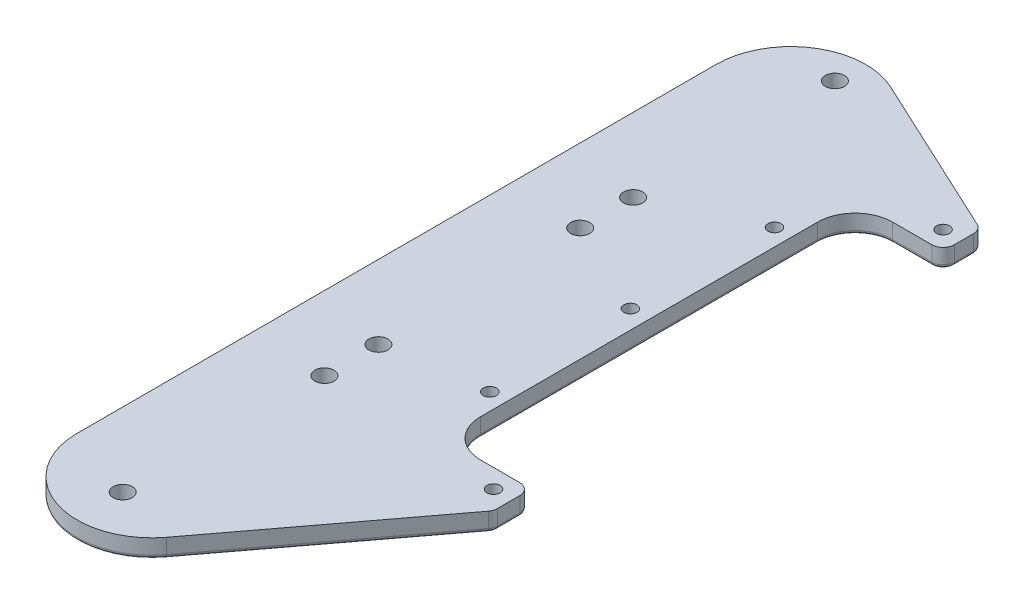
from build123d import *

# Parameters (mm, degrees)
SKETCH1_R               = 1.75
BOSS_EXTRUDE1_DEPTH     = 5
FILLET3_R               = 10
FILLET4_R               = 3
FILLET5_R               = 20
SKETCH2_R               = 4
BOSS_EXTRUDE2_DEPTH     = 5
SKETCH3_R               = 2.55
CUT_EXTRUDE1_DEPTH      = 7
CUT_EXTRUDE2_DEPTH      = 132.108761036
CUT_EXTRUDE2_DEPTH_BACK = 132.108761036
SKETCH4_R               = 1.55
FILLET6_R               = 2
FILLET7_R               = 1
SKETCH6_W               = 1.346153846
SKETCH6_H               = 0.358974359
SKETCH6_W_2             = 0.314102564
SKETCH6_H_2             = 2.557692308
CUT_EXTRUDE3_DEPTH      = 1


with BuildPart() as part:
    # Sketch1 → Boss-Extrude1 (new body)
    with BuildSketch(Plane(origin=(0, 0, 0), x_dir=(1, 0, 0), z_dir=(0, 1, 0))):
        Polygon((28.48, -65), (28.48, -55), (5, -55), (5, 55), (28.48, 55), (28.48, 65), (-45, 99.264286721), (-45, -162.511253493), align=None)
        with Locations(Location((0, 0, 0), (0, 0, 270))):
            Circle(SKETCH1_R, mode=Mode.SUBTRACT)
        with Locations(Location((0.48, -38, 0), (0, 0, 270))):
            Circle(SKETCH1_R, mode=Mode.SUBTRACT)
        with Locations(Location((23.48, -60, 0), (0, 0, 270))):
            Circle(SKETCH1_R, mode=Mode.SUBTRACT)
        with Locations(Location((0.48, 38, 0), (0, 0, 270))):
            Circle(SKETCH1_R, mode=Mode.SUBTRACT)
        with Locations(Location((23.48, 60, 0), (0, 0, 270))):
            Circle(SKETCH1_R, mode=Mode.SUBTRACT)
    extrude(amount=BOSS_EXTRUDE1_DEPTH)

    # Fillet3
    fillet3_edges = [part.edges().sort_by_distance(p)[0] for p in [
        (5, 2.5, -55),
        (5, 2.5, 55),
    ]]
    fillet(fillet3_edges, radius=FILLET3_R)

    # Fillet4
    fillet4_edges = [part.edges().sort_by_distance(p)[0] for p in [
        (28.48, 2.5, -65),
        (28.48, 2.5, -55),
        (28.48, 2.5, 55),
        (28.48, 2.5, 65),
    ]]
    fillet(fillet4_edges, radius=FILLET4_R)

    # Fillet5
    fillet5_edges = [part.edges().sort_by_distance(p)[0] for p in [
        (-45, 2.5, 162.511253493),
        (-45, 2.5, -99.264286721),
    ]]
    fillet(fillet5_edges, radius=FILLET5_R)

    # Sketch2 → Boss-Extrude2 (add)
    with BuildSketch(Plane.XZ):
        with Locations(Location((-25.327332377, 41.933648737, 0), (0, 0, 90))):
            Circle(SKETCH2_R)
        with Locations(Location((-25.327332377, -11.933648737, 0), (0, 0, 90))):
            Circle(SKETCH2_R)
        with Locations(Location((-25.327332377, -26.066351263, 0), (0, 0, 90))):
            Circle(SKETCH2_R)
        with Locations(Location((-25.327332377, -79.933648737, 0), (0, 0, 90))):
            Circle(SKETCH2_R)
        with Locations(Location((-25.327332377, 56.343433273, 0), (0, 0, 90))):
            Circle(SKETCH2_R)
        with Locations(Location((-25.327332377, 110.210730748, 0), (0, 0, 90))):
            Circle(SKETCH2_R)
    extrude(amount=BOSS_EXTRUDE2_DEPTH)

    # Sketch3 → Cut-Extrude1 (cut)
    with BuildSketch(Plane(origin=(0, 5, 0), x_dir=(1, 0, 0), z_dir=(0, 1, 0))):
        with Locations(Location((-25.327332377, 79.933648737, 0), (0, 0, 270))):
            Circle(SKETCH3_R)
        with Locations(Location((-25.327332377, 26.066351263, 0), (0, 0, 270))):
            Circle(SKETCH3_R)
        with Locations(Location((-25.327332377, 11.933648737, 0), (0, 0, 270))):
            Circle(SKETCH3_R)
        with Locations(Location((-25.327332377, -41.933648737, 0), (0, 0, 270))):
            Circle(SKETCH3_R)
        with Locations(Location((-25.327332377, -56.343433273, 0), (0, 0, 270))):
            Circle(SKETCH3_R)
        with Locations(Location((-25.327332377, -110.210730748, 0), (0, 0, 270))):
            Circle(SKETCH3_R)
    extrude(amount=-CUT_EXTRUDE1_DEPTH, mode=Mode.SUBTRACT)

    # Sketch4 → Cut-Extrude2 (cut, two sides: drawn at the far end of the back side and taken through both)
    with BuildSketch(Plane.XZ.offset(5).offset(-CUT_EXTRUDE2_DEPTH_BACK)):
        with Locations(Location((-25.327332377, -79.933648737, 0), (0, 0, 90))):
            Circle(SKETCH4_R)
        with Locations(Location((-25.327332377, -26.066351263, 0), (0, 0, 90))):
            Circle(SKETCH4_R)
        with Locations(Location((-25.327332377, -11.933648737, 0), (0, 0, 90))):
            Circle(SKETCH4_R)
        with Locations(Location((-25.327332377, 41.933648737, 0), (0, 0, 90))):
            Circle(SKETCH4_R)
        with Locations(Location((-25.327332377, 56.343433273, 0), (0, 0, 90))):
            Circle(SKETCH4_R)
        with Locations(Location((-25.327332377, 110.210730748, 0), (0, 0, 90))):
            Circle(SKETCH4_R)
    extrude(amount=CUT_EXTRUDE2_DEPTH + CUT_EXTRUDE2_DEPTH_BACK, mode=Mode.SUBTRACT)

    # Fillet6
    fillet6_edges = [part.edges().sort_by_distance(p)[0] for p in [
        (-25.327332377, 0, -30.066351263),
        (-25.327332377, -5, -30.066351263),
        (-25.327332377, 0, -83.933648737),
        (-25.327332377, -5, -83.933648737),
        (-25.327332377, 0, 52.343433273),
        (-25.327332377, -5, 52.343433273),
        (-25.327332377, 0, 106.210730748),
        (-25.327332377, -5, 106.210730748),
        (-25.327332377, 0, 37.933648737),
        (-25.327332377, -5, 37.933648737),
        (-25.327332377, 0, -15.933648737),
        (-25.327332377, -5, -15.933648737),
    ]]
    fillet(fillet6_edges, radius=FILLET6_R)

    # Fillet7
    fillet7_edges = [part.edges().sort_by_distance(p)[0] for p in [
        (5, 0, 0),
        (20.24, 0, -55),
        (7.928932188, 0, 52.071067812),
        (7.928932188, 0, -52.071067812),
        (5.10011001, 0, -75.902221749),
        (28.48, 0, -60.544394609),
        (20.24, 0, 55),
        (28.48, 0, 60.998107021),
        (27.601320344, 0, -55.878679656),
        (27.601320344, 0, 55.878679656),
        (28.324970966, 0, 64.948128011),
        (28.010174337, 0, -64.700688043),
        (9.424308366, 0, 90.287756906),
        (-45, 0, 17.433489529),
        (-35.745992167, 0, -84.738404095),
        (-31.346093128, 0, 121.704027342),
    ]]
    fillet(fillet7_edges, radius=FILLET7_R)

    # Sketch6 → Cut-Extrude3 (cut)
    # profile 1 of 27: a face of its own
    with BuildSketch(Plane(origin=(0, 0, 0), x_dir=(-1, 0, 0), z_dir=(0, -1, 0))):
        with BuildLine():
            Line((37.576923077, 59.5), (38.263321314, 59.5))
            add(Edge.make_bspline(
                [(38.263321314, 59.5), (38.31053222, 59.499948104), (38.400990413, 59.499848668), (38.530705469, 59.496833922), (38.6485152, 59.49280723), (38.754165581, 59.487225337), (38.847981679, 59.480628747), (38.929538979, 59.471376708), (38.999478535, 59.461716412), (39.041384985, 59.451895005), (39.060496795, 59.447415865)],
                knots=[0, 0, 0, 0, 1.415646017, 2.712440637, 3.8905458, 4.950247383, 5.884950622, 6.709939814, 7.411656543, 8, 8, 8, 8], degree=3))
            add(Edge.make_bspline(
                [(39.060496795, 59.447415865), (39.084690329, 59.440793916), (39.132507306, 59.427706054), (39.201408349, 59.40149233), (39.266962194, 59.370410165), (39.329393753, 59.334986225), (39.387935836, 59.293700661), (39.443461877, 59.248227043), (39.495481857, 59.197515475), (39.543703249, 59.142134735), (39.587988047, 59.083014525), (39.626117729, 59.019272295), (39.658044956, 58.951980992), (39.685428228, 58.881187421), (39.705136682, 58.806297097), (39.719983582, 58.727830385), (39.72940721, 58.645795695), (39.730309771, 58.589735827), (39.730769231, 58.561197917)],
                knots=[0, 0, 0, 0, 0.999701418, 1.975846123, 2.934577507, 3.890451536, 4.834027766, 5.787354733, 6.749476667, 7.726910423, 8.712836071, 9.690891519, 10.682875813, 11.679750201, 12.712814741, 13.765529915, 14.8625177, 16, 16, 16, 16], degree=3))
            add(Edge.make_bspline(
                [(39.730769231, 58.561197917), (39.730347806, 58.53242014), (39.72952326, 58.476114476), (39.719626975, 58.393741688), (39.706296783, 58.315023298), (39.685799731, 58.240133847), (39.658954058, 58.169518077), (39.627462005, 58.102096845), (39.589478475, 58.039017173), (39.545833645, 57.980050055), (39.49728205, 57.925140143), (39.444029112, 57.874685348), (39.38628982, 57.82898101), (39.324247672, 57.787924666), (39.257297823, 57.752468387), (39.186455669, 57.720711082), (39.111105453, 57.694040021), (39.058962939, 57.68000996), (39.032451923, 57.672876603)],
                knots=[0, 0, 0, 0, 1.121902311, 2.195077645, 3.232258892, 4.234102512, 5.217864754, 6.176164875, 7.132989551, 8.084763148, 9.034132444, 9.988522005, 10.94243251, 11.903244335, 12.886203696, 13.894208494, 14.929344452, 16, 16, 16, 16], degree=3))
            add(Edge.make_bspline(
                [(39.032451923, 57.672876603), (39.010524589, 57.668213621), (38.962469562, 57.657994427), (38.88332684, 57.64658597), (38.791181454, 57.63684837), (38.686159174, 57.629547232), (38.568354269, 57.623296864), (38.437703011, 57.61832877), (38.293948934, 57.615598916), (38.19367769, 57.615458123), (38.141326122, 57.615384615)],
                knots=[0, 0, 0, 0, 0.601384939, 1.31797006, 2.144135048, 3.087295005, 4.142315834, 5.309527816, 6.595305764, 8, 8, 8, 8], degree=3))
            Line((38.141326122, 57.615384615), (37.891025641, 57.615384615))
            Line((37.891025641, 57.615384615), (37.891025641, 56))
            Line((37.891025641, 56), (37.576923077, 56))
            Line((37.576923077, 56), (37.576923077, 59.5))
        make_face()
        with BuildLine():
            Line((37.891025641, 59.141025641), (37.891025641, 57.974358974))
            Line((37.891025641, 57.974358974), (38.50380609, 57.966646635))
            add(Edge.make_bspline(
                [(38.50380609, 57.966646635), (38.533726016, 57.966631171), (38.591485815, 57.966601319), (38.674922039, 57.970586542), (38.752331326, 57.975187075), (38.823475901, 57.981922998), (38.888387836, 57.991444256), (38.947175365, 58.001055994), (38.999382648, 58.014961356), (39.060481849, 58.033684426), (39.128565197, 58.065617041), (39.202632745, 58.111966931), (39.265403332, 58.17104764), (39.319721629, 58.237475471), (39.362827506, 58.3113746), (39.394383499, 58.390443537), (39.412924656, 58.473871387), (39.41541085, 58.530959525), (39.416666667, 58.559795673)],
                knots=[0, 0, 0, 0, 1.160613943, 2.240541288, 3.23993089, 4.169200891, 5.011653406, 5.7853311, 6.478053781, 7.106038997, 8.262395093, 9.384106736, 10.481365981, 11.59014053, 12.70357646, 13.786202915, 14.881775077, 16, 16, 16, 16], degree=3))
            add(Edge.make_bspline(
                [(39.416666667, 58.559795673), (39.41540402, 58.587934187), (39.412894035, 58.643870069), (39.394238172, 58.725848829), (39.362888858, 58.804084534), (39.319432264, 58.877057619), (39.266691134, 58.943246423), (39.205391791, 59.00074355), (39.135678529, 59.046965253), (39.070830298, 59.076798534), (39.013229112, 59.09501381), (38.963197152, 59.10775865), (38.906706478, 59.117934257), (38.843738698, 59.126173759), (38.774781864, 59.133227221), (38.69924355, 59.138013198), (38.617409906, 59.140814654), (38.560599335, 59.140953609), (38.53114984, 59.141025641)],
                knots=[0, 0, 0, 0, 1.120700087, 2.227813068, 3.331159281, 4.466773991, 5.599788987, 6.693661531, 7.80175334, 8.91857717, 9.525282508, 10.207424825, 10.974604443, 11.810962634, 12.737642355, 13.736264703, 14.826523623, 16, 16, 16, 16], degree=3))
            Line((38.53114984, 59.141025641), (37.891025641, 59.141025641))
        make_face(mode=Mode.SUBTRACT)
    # profile 2 of 27: a face of its own
    with BuildSketch(Plane(origin=(0, 0, 0), x_dir=(-1, 0, 0), z_dir=(0, -1, 0))):
        with BuildLine():
            Line((34.435897436, 59.5), (34.75, 59.5))
            Line((34.75, 59.5), (34.75, 57.402944712))
            add(Edge.make_bspline(
                [(34.75, 57.402944712), (34.749953256, 57.373263976), (34.749864551, 57.316939665), (34.750457065, 57.236771364), (34.752116434, 57.165498905), (34.753162593, 57.102847558), (34.755489927, 57.04910481), (34.757387974, 57.0039795), (34.75982853, 56.967685297), (34.762761648, 56.946504371), (34.764022436, 56.93739984)],
                knots=[0, 0, 0, 0, 1.528628734, 2.90083645, 4.128790002, 5.200304208, 6.127813768, 6.898992206, 7.526736466, 8, 8, 8, 8], degree=3))
            add(Edge.make_bspline(
                [(34.764022436, 56.93739984), (34.769199895, 56.904553076), (34.779263081, 56.840710347), (34.804909459, 56.749802065), (34.84072696, 56.667870607), (34.883170003, 56.592359316), (34.939102614, 56.525369956), (35.006106149, 56.463658303), (35.087283918, 56.409686499), (35.177544523, 56.360335687), (35.274829761, 56.320670604), (35.374241027, 56.29067724), (35.474284006, 56.27239834), (35.541260171, 56.270281801), (35.574519231, 56.269230769)],
                knots=[0, 0, 0, 0, 1.035780045, 2.013197591, 2.933192213, 3.817615948, 4.702609284, 5.640816605, 6.646850145, 7.73207398, 8.84249596, 9.914020372, 10.964143139, 12, 12, 12, 12], degree=3))
            add(Edge.make_bspline(
                [(35.574519231, 56.269230769), (35.603072971, 56.27030462), (35.660015533, 56.272446118), (35.744621964, 56.285707549), (35.827022072, 56.309608115), (35.907622752, 56.340447873), (35.983173737, 56.381195464), (36.053717179, 56.428266303), (36.116681113, 56.48347718), (36.174139111, 56.544577524), (36.224174047, 56.613517324), (36.267545188, 56.688795462), (36.303071118, 56.771544809), (36.320614643, 56.829699231), (36.329627404, 56.859575321)],
                knots=[0, 0, 0, 0, 0.994687771, 1.983630487, 2.973142513, 3.978332533, 4.983357753, 5.956394766, 6.925816176, 7.893390482, 8.871859704, 9.88551698, 10.913711441, 12, 12, 12, 12], degree=3))
            add(Edge.make_bspline(
                [(36.329627404, 56.859575321), (36.332627529, 56.871923895), (36.339313017, 56.899441495), (36.345560062, 56.945962785), (36.352066588, 57.000852149), (36.356581158, 57.064503962), (36.360982378, 57.136704935), (36.363615451, 57.217831192), (36.364832484, 57.307588153), (36.365195164, 57.370225315), (36.365384615, 57.402944712)],
                knots=[0, 0, 0, 0, 0.558680831, 1.244966039, 2.062412453, 2.990489873, 4.051219941, 5.244515665, 6.560634259, 8, 8, 8, 8], degree=3))
            Line((36.365384615, 57.402944712), (36.365384615, 59.5))
            Line((36.365384615, 59.5), (36.679487179, 59.5))
            Line((36.679487179, 59.5), (36.679487179, 57.386117788))
            add(Edge.make_bspline(
                [(36.679487179, 57.386117788), (36.679233059, 57.34801941), (36.678737128, 57.273668107), (36.674436551, 57.164716748), (36.667579551, 57.061363766), (36.657891463, 56.96359527), (36.64505446, 56.871761111), (36.63077924, 56.785056342), (36.612599707, 56.70410335), (36.591366305, 56.628270932), (36.567092757, 56.556085419), (36.535651609, 56.487576804), (36.500227109, 56.420662404), (36.458212456, 56.356354295), (36.411001074, 56.294367742), (36.357549393, 56.235078667), (36.299625232, 56.177539621), (36.236265672, 56.123226555), (36.168515147, 56.073417878), (36.096575189, 56.029620107), (36.02099842, 55.992596489), (35.941981294, 55.962120565), (35.859490091, 55.939205966), (35.773522731, 55.92213081), (35.683883538, 55.912428513), (35.622918881, 55.910986582), (35.592047276, 55.91025641)],
                knots=[0, 0, 0, 0, 1.316592851, 2.569410997, 3.76748051, 4.895814652, 5.963796859, 6.97159953, 7.931736103, 8.829262218, 9.692595152, 10.560224239, 11.431080259, 12.30701507, 13.211635791, 14.121146779, 15.063487852, 16.031507147, 17.00238618, 17.966455255, 18.938106653, 19.907068911, 20.888905087, 21.893141452, 22.933117798, 24, 24, 24, 24], degree=3))
            add(Edge.make_bspline(
                [(35.592047276, 55.91025641), (35.558378173, 55.911041176), (35.492319514, 55.912580882), (35.394981447, 55.921403632), (35.301667251, 55.938022027), (35.211391374, 55.95918197), (35.125382876, 55.988365708), (35.042489432, 56.022463832), (34.964130751, 56.064341093), (34.889035622, 56.110934486), (34.819210866, 56.163359124), (34.755113463, 56.220499298), (34.696637592, 56.281439675), (34.644768896, 56.346840041), (34.598648012, 56.416191748), (34.558917798, 56.489690988), (34.524804554, 56.567309304), (34.507197987, 56.621262504), (34.498297276, 56.64853766)],
                knots=[0, 0, 0, 0, 1.13879206, 2.234305948, 3.301075583, 4.341971843, 5.366689343, 6.369221514, 7.369726634, 8.367512178, 9.355451585, 10.318319045, 11.268648973, 12.207971039, 13.137398894, 14.081662264, 15.030215811, 16, 16, 16, 16], degree=3))
            add(Edge.make_bspline(
                [(34.498297276, 56.64853766), (34.493120117, 56.667170235), (34.481890746, 56.707584704), (34.469865448, 56.774471192), (34.459756367, 56.85148611), (34.450250809, 56.938634728), (34.444641851, 57.035984595), (34.439724412, 57.143493511), (34.435862793, 57.261291472), (34.435885566, 57.343345988), (34.435897436, 57.386117788)],
                knots=[0, 0, 0, 0, 0.625038921, 1.35572334, 2.194682327, 3.136881307, 4.189498639, 5.346923369, 6.617055217, 8, 8, 8, 8], degree=3))
            Line((34.435897436, 57.386117788), (34.435897436, 59.5))
        make_face()
    # profile 3 of 27: a face of its own
    with BuildSketch(Plane(origin=(0, 0, 0), x_dir=(-1, 0, 0), z_dir=(0, -1, 0))):
        Polygon((32.237179487, 59.5), (32.506410256, 59.5), (33.673076923, 56.852564103), (33.334435096, 56.852564103), (32.371794872, 59.036558494), (31.409154647, 56.852564103), (31.070512821, 56.852564103), align=None)
    # profile 4 of 27: a face of its own
    with BuildSketch(Plane(origin=(0, 0, 0), x_dir=(-1, 0, 0), z_dir=(0, -1, 0))):
        with BuildLine():
            Line((37.891025641, 51.58974359), (37.576923077, 51.58974359))
            add(Edge.make_bspline(
                [(37.576923077, 51.58974359), (37.57897023, 51.631414478), (37.582990784, 51.713254992), (37.601819073, 51.832578898), (37.62875995, 51.946633697), (37.666851404, 52.054503611), (37.714157682, 52.157142418), (37.77088771, 52.254142434), (37.83808156, 52.345133623), (37.914288294, 52.429272466), (37.997056933, 52.506460037), (38.086362873, 52.57311528), (38.1802079, 52.629432951), (38.278307299, 52.676514193), (38.381767862, 52.711854039), (38.48965072, 52.738075678), (38.602429857, 52.753852024), (38.679269879, 52.75554781), (38.718349359, 52.756410256)],
                knots=[0, 0, 0, 0, 1.10065271, 2.161652631, 3.183658789, 4.190468796, 5.17591951, 6.163126047, 7.15150782, 8.156236427, 9.156009102, 10.134482811, 11.092018607, 12.041330605, 13.001268258, 13.972401359, 14.968799086, 16, 16, 16, 16], degree=3))
            add(Edge.make_bspline(
                [(38.718349359, 52.756410256), (38.756727433, 52.7555118), (38.832138978, 52.753746365), (38.942200992, 52.738585336), (39.046978287, 52.714839744), (39.146266053, 52.681524328), (39.239272118, 52.636739901), (39.326695162, 52.582942362), (39.409575973, 52.520722531), (39.484182757, 52.447468717), (39.552690836, 52.369266333), (39.611793091, 52.285778429), (39.662406255, 52.199549143), (39.704593934, 52.109920942), (39.735650073, 52.016049913), (39.759228281, 51.91930271), (39.772555695, 51.818677899), (39.774601119, 51.750571344), (39.775641026, 51.715945513)],
                knots=[0, 0, 0, 0, 1.111607364, 2.184268762, 3.212621178, 4.221274766, 5.211760367, 6.196651075, 7.1921475, 8.207485113, 9.220403448, 10.201281604, 11.166441695, 12.114753415, 13.065576456, 14.026450734, 14.996634279, 16, 16, 16, 16], degree=3))
            add(Edge.make_bspline(
                [(39.775641026, 51.715945513), (39.773947763, 51.667197678), (39.770590951, 51.570557465), (39.741876575, 51.428542602), (39.697030064, 51.290949183), (39.643032707, 51.180211881), (39.588560263, 51.090978387), (39.539472755, 51.017509682), (39.482007944, 50.938404214), (39.415329446, 50.853926876), (39.340816574, 50.763415971), (39.257794411, 50.666926176), (39.165670929, 50.565454406), (39.101012428, 50.496148805), (39.067508013, 50.460236378)],
                knots=[0, 0, 0, 0, 1.184426356, 2.348067706, 3.509069118, 4.696110526, 5.333549288, 6.050745305, 6.844228056, 7.710549037, 8.667450064, 9.695053472, 10.805634456, 12, 12, 12, 12], degree=3))
            Line((39.067508013, 50.460236378), (38.191806891, 49.525641026))
            Line((38.191806891, 49.525641026), (39.820512821, 49.525641026))
            Line((39.820512821, 49.525641026), (39.820512821, 49.166666667))
            Line((39.820512821, 49.166666667), (37.442307692, 49.166666667))
            Line((37.442307692, 49.166666667), (38.799679487, 50.615184295))
            add(Edge.make_bspline(
                [(38.799679487, 50.615184295), (38.832727374, 50.649682601), (38.896205601, 50.715946788), (38.985988178, 50.812689748), (39.066627166, 50.902439289), (39.138644559, 50.985025837), (39.200478064, 51.061657405), (39.255350296, 51.129852109), (39.299315887, 51.192606559), (39.347031283, 51.265347173), (39.393245264, 51.35415949), (39.43295762, 51.462693179), (39.457172469, 51.574420432), (39.460077304, 51.649922469), (39.461538462, 51.687900641)],
                knots=[0, 0, 0, 0, 1.329631726, 2.553950428, 3.673215718, 4.687767853, 5.603093632, 6.413772471, 7.123043292, 7.734684054, 8.834405432, 9.900288307, 10.943827018, 12, 12, 12, 12], degree=3))
            add(Edge.make_bspline(
                [(39.461538462, 51.687900641), (39.460902719, 51.711782039), (39.459649793, 51.75884769), (39.448592096, 51.827853449), (39.43188159, 51.894418263), (39.407936332, 51.958746882), (39.376329592, 52.020192534), (39.337856212, 52.078830014), (39.293466148, 52.135518979), (39.242114879, 52.188672277), (39.185703359, 52.237353483), (39.126109109, 52.280477568), (39.063059005, 52.316516679), (38.996818883, 52.346060176), (38.927573414, 52.369235557), (38.855188669, 52.385294137), (38.779864652, 52.395376621), (38.728431157, 52.396740793), (38.702223558, 52.397435897)],
                knots=[0, 0, 0, 0, 0.991446411, 1.95395049, 2.89581595, 3.838931463, 4.798493298, 5.75982156, 6.748411868, 7.785213223, 8.824556874, 9.840280684, 10.836137867, 11.835679398, 12.848801643, 13.863922112, 14.911575587, 16, 16, 16, 16], degree=3))
            add(Edge.make_bspline(
                [(38.702223558, 52.397435897), (38.674852725, 52.396720865), (38.621100929, 52.39531666), (38.542181896, 52.385493996), (38.466896118, 52.368548155), (38.395054215, 52.345371481), (38.326534629, 52.315912932), (38.261670585, 52.279221188), (38.200607696, 52.235437694), (38.143231173, 52.185797138), (38.090367194, 52.130529537), (38.043920318, 52.068919574), (38.003336304, 52.002092158), (37.96792707, 51.930227608), (37.93917138, 51.852673828), (37.91719823, 51.769706123), (37.899811383, 51.681684742), (37.894002862, 51.620899657), (37.891025641, 51.58974359)],
                knots=[0, 0, 0, 0, 1.031018746, 2.02475058, 2.990194455, 3.934040569, 4.864654155, 5.795059489, 6.735614925, 7.690564532, 8.649604399, 9.611025574, 10.590972636, 11.591080095, 12.624614302, 13.701020113, 14.821632451, 16, 16, 16, 16], degree=3))
        make_face()
    # profile 5 of 27: a face of its own
    with BuildSketch(Plane(origin=(0, 0, 0), x_dir=(-1, 0, 0), z_dir=(0, -1, 0))):
        Polygon((34.121794872, 52.666666667), (34.458333333, 52.666666667), (35.625, 49.908453526), (36.791666667, 52.666666667), (37.128205128, 52.666666667), (35.647435897, 49.166666667), (35.602564103, 49.166666667), align=None)
    # profile 6 of 27: a face of its own
    with BuildSketch(Plane(origin=(0, 0, 0), x_dir=(-1, 0, 0), z_dir=(0, -1, 0))):
        Polygon((31.653846154, 52.756410256), (31.967948718, 52.756410256), (31.967948718, 51.724358974), (32.416666667, 51.724358974), (32.416666667, 51.41025641), (31.967948718, 51.41025641), (31.967948718, 49.166666667), (31.653846154, 49.166666667), (31.653846154, 51.41025641), (31.205128205, 51.41025641), (31.205128205, 51.724358974), (31.653846154, 51.724358974), align=None)
    # profile 7 of 27: a face of its own
    with BuildSketch(Plane(origin=(0, 0, 0), x_dir=(-1, 0, 0), z_dir=(0, -1, 0))):
        with BuildLine():
            Line((28.378205128, 51.724358974), (28.692307692, 51.724358974))
            Line((28.692307692, 51.724358974), (28.692307692, 51.263020833))
            add(Edge.make_bspline(
                [(28.692307692, 51.263020833), (28.725845327, 51.304863556), (28.790926278, 51.38606082), (28.899310612, 51.492781394), (29.013854512, 51.580726619), (29.133856516, 51.650830413), (29.259479526, 51.703677039), (29.389957796, 51.74184297), (29.526072502, 51.764727799), (29.618636939, 51.767718029), (29.665464744, 51.769230769)],
                knots=[0, 0, 0, 0, 1.12780773, 2.188550248, 3.19190651, 4.159438251, 5.104880172, 6.052711206, 7.014878035, 8, 8, 8, 8], degree=3))
            add(Edge.make_bspline(
                [(29.665464744, 51.769230769), (29.712795378, 51.767485574), (29.805432845, 51.764069805), (29.940310907, 51.737053114), (30.066284301, 51.690907859), (30.182903856, 51.627695789), (30.28803107, 51.549089315), (30.380355921, 51.457511534), (30.456719169, 51.35217545), (30.507916532, 51.254452294), (30.541642179, 51.1677635), (30.562874517, 51.09351675), (30.580905498, 51.010798599), (30.596537246, 50.919859009), (30.607114358, 50.820060819), (30.61545665, 50.711813127), (30.621435344, 50.595150997), (30.621672551, 50.514464369), (30.621794872, 50.472856571)],
                knots=[0, 0, 0, 0, 1.235846778, 2.418850247, 3.575807741, 4.728682307, 5.871620074, 6.994088408, 8.11269785, 9.256955736, 9.865816715, 10.540099792, 11.271859618, 12.076849838, 12.949306005, 13.892391288, 14.913166135, 16, 16, 16, 16], degree=3))
            Line((30.621794872, 50.472856571), (30.621794872, 49.166666667))
            Line((30.621794872, 49.166666667), (30.307692308, 49.166666667))
            Line((30.307692308, 49.166666667), (30.307692308, 50.369791667))
            add(Edge.make_bspline(
                [(30.307692308, 50.369791667), (30.3074991, 50.404614112), (30.307129526, 50.471223522), (30.305963879, 50.566592546), (30.303154072, 50.653079124), (30.299205759, 50.730476491), (30.293426729, 50.798710328), (30.287404098, 50.857919605), (30.280039121, 50.908029147), (30.273476208, 50.938194229), (30.270532853, 50.951722756)],
                knots=[0, 0, 0, 0, 1.430800155, 2.736877192, 3.918605307, 4.986035426, 5.920637409, 6.731861385, 7.431261377, 8, 8, 8, 8], degree=3))
            add(Edge.make_bspline(
                [(30.270532853, 50.951722756), (30.259907321, 50.991433941), (30.23945646, 51.067865686), (30.188922477, 51.171540039), (30.125108296, 51.259738226), (30.047210447, 51.331914948), (29.955981371, 51.388085785), (29.851674229, 51.427059739), (29.735295588, 51.451436009), (29.653441205, 51.453863141), (29.610777244, 51.455128205)],
                knots=[0, 0, 0, 0, 1.084156227, 2.086665306, 3.027808233, 3.945421172, 4.874247719, 5.839848303, 6.874090471, 8, 8, 8, 8], degree=3))
            add(Edge.make_bspline(
                [(29.610777244, 51.455128205), (29.58550956, 51.4546522), (29.535505467, 51.4537102), (29.461355495, 51.444258902), (29.389431322, 51.428800446), (29.319011113, 51.407931808), (29.251503319, 51.379269539), (29.184739028, 51.346740169), (29.121232264, 51.306191957), (29.059628867, 51.261001336), (29.002316059, 51.210922128), (28.948987721, 51.158077618), (28.9014497, 51.101802014), (28.858381025, 51.043002067), (28.821202762, 50.980870229), (28.788749674, 50.916005922), (28.761213979, 50.848323774), (28.747531286, 50.801348712), (28.740685096, 50.777844551)],
                knots=[0, 0, 0, 0, 1.023777757, 2.026029729, 3.023749952, 4.003683103, 4.997618607, 5.993177895, 7.010360494, 8.046726602, 9.087585522, 10.09234134, 11.086953743, 12.070360549, 13.043493632, 14.017870808, 15.008233677, 16, 16, 16, 16], degree=3))
            add(Edge.make_bspline(
                [(28.740685096, 50.777844551), (28.736745448, 50.760589348), (28.728169039, 50.723025674), (28.718905859, 50.661381254), (28.710498283, 50.590071279), (28.703461325, 50.509178962), (28.699155908, 50.418421087), (28.694461512, 50.318185249), (28.692752451, 50.208071761), (28.692460097, 50.131410068), (28.692307692, 50.091446314)],
                knots=[0, 0, 0, 0, 0.615963638, 1.340920617, 2.168419149, 3.115676021, 4.16674242, 5.331190069, 6.6087489, 8, 8, 8, 8], degree=3))
            Line((28.692307692, 50.091446314), (28.692307692, 49.166666667))
            Line((28.692307692, 49.166666667), (28.378205128, 49.166666667))
            Line((28.378205128, 49.166666667), (28.378205128, 51.724358974))
        make_face()
    # profile 8 of 27: a face of its own
    with BuildSketch(Plane(origin=(0, 0, 0), x_dir=(-1, 0, 0), z_dir=(0, -1, 0))):
        with BuildLine():
            Line((25.371794872, 51.724358974), (25.685897436, 51.724358974))
            Line((25.685897436, 51.724358974), (25.685897436, 50.538060897))
            add(Edge.make_bspline(
                [(25.685897436, 50.538060897), (25.686039341, 50.503238148), (25.686310798, 50.43662386), (25.688151739, 50.340768673), (25.692481833, 50.253351961), (25.697895657, 50.174323224), (25.704857793, 50.103695832), (25.713141154, 50.041716475), (25.722399576, 49.987682291), (25.73146229, 49.955138936), (25.735677083, 49.940004006)],
                knots=[0, 0, 0, 0, 1.388932606, 2.656963016, 3.823490214, 4.879454478, 5.816252168, 6.653371382, 7.373723809, 8, 8, 8, 8], degree=3))
            add(Edge.make_bspline(
                [(25.735677083, 49.940004006), (25.742438538, 49.920981135), (25.755820879, 49.883330874), (25.780094363, 49.828941869), (25.8101227, 49.778566587), (25.842982528, 49.730262514), (25.880881935, 49.685460527), (25.923341406, 49.644236283), (25.968939643, 49.605032192), (26.036694667, 49.5586474), (26.129353933, 49.50893207), (26.251006688, 49.466036252), (26.382910914, 49.440400432), (26.474075633, 49.437426177), (26.520933494, 49.435897436)],
                knots=[0, 0, 0, 0, 0.725840625, 1.436591201, 2.137033971, 2.831655856, 3.53531722, 4.242432219, 4.957935707, 5.694543706, 7.190802206, 8.724350549, 10.316345118, 12, 12, 12, 12], degree=3))
            add(Edge.make_bspline(
                [(26.520933494, 49.435897436), (26.567787001, 49.437458684), (26.65843987, 49.440479412), (26.788894839, 49.46526295), (26.908146253, 49.506668639), (27.014997205, 49.564476051), (27.108963045, 49.635218114), (27.187267464, 49.718226923), (27.251874718, 49.810876309), (27.280084139, 49.880000588), (27.294270833, 49.914763622)],
                knots=[0, 0, 0, 0, 1.157059328, 2.238695713, 3.266970494, 4.264342957, 5.228770407, 6.160125903, 7.074715775, 8, 8, 8, 8], degree=3))
            add(Edge.make_bspline(
                [(27.294270833, 49.914763622), (27.298465063, 49.92872992), (27.307737482, 49.959605996), (27.317699833, 50.011985744), (27.326674295, 50.074450349), (27.334337471, 50.147408557), (27.339802634, 50.23066971), (27.34274866, 50.324207786), (27.346076935, 50.427729146), (27.346127452, 50.500196906), (27.346153846, 50.538060897)],
                knots=[0, 0, 0, 0, 0.557542046, 1.232589297, 2.036731608, 2.971723315, 4.038036528, 5.22795436, 6.551621927, 8, 8, 8, 8], degree=3))
            Line((27.346153846, 50.538060897), (27.346153846, 51.724358974))
            Line((27.346153846, 51.724358974), (27.66025641, 51.724358974))
            Line((27.66025641, 51.724358974), (27.66025641, 50.479166667))
            add(Edge.make_bspline(
                [(27.66025641, 50.479166667), (27.659814715, 50.436859495), (27.658957767, 50.354777795), (27.653450424, 50.235493684), (27.644000811, 50.124331439), (27.629658126, 50.021232219), (27.612792451, 49.926274737), (27.591036178, 49.839337291), (27.565057941, 49.760687737), (27.535752426, 49.688945961), (27.501130558, 49.623899066), (27.464303538, 49.56216325), (27.421778766, 49.505270315), (27.377008532, 49.450388177), (27.327206876, 49.40024665), (27.273307017, 49.353695174), (27.216067597, 49.310022142), (27.154218399, 49.270930863), (27.088662336, 49.235714218), (27.019318479, 49.204498139), (26.945337481, 49.179795562), (26.867673844, 49.158484897), (26.785947064, 49.141770428), (26.700235931, 49.129983861), (26.610569315, 49.12275853), (26.549459855, 49.122121485), (26.518129006, 49.121794872)],
                knots=[0, 0, 0, 0, 1.493040784, 2.896703357, 4.213163133, 5.428574705, 6.569057535, 7.615249723, 8.588095153, 9.490268104, 10.346124644, 11.18633936, 12.024365274, 12.850166724, 13.684164916, 14.514361689, 15.362232829, 16.222528818, 17.093394965, 17.986930858, 18.902426812, 19.842810585, 20.827885679, 21.843828298, 22.894529745, 24, 24, 24, 24], degree=3))
            add(Edge.make_bspline(
                [(26.518129006, 49.121794872), (26.487032492, 49.122134579), (26.425924947, 49.122802135), (26.336253703, 49.129943943), (26.250305097, 49.141752113), (26.168384698, 49.158607331), (26.090410301, 49.179646401), (26.016066061, 49.204649936), (25.946222498, 49.235730418), (25.880040494, 49.270707975), (25.818038106, 49.310273251), (25.759929528, 49.353641291), (25.705792675, 49.400747354), (25.655615607, 49.451394711), (25.610102631, 49.506211647), (25.568686589, 49.564757207), (25.530729884, 49.626451296), (25.496377093, 49.692514458), (25.466865338, 49.765086468), (25.440810092, 49.845383565), (25.419499454, 49.934286082), (25.402156985, 50.031718011), (25.388205545, 50.137213052), (25.378519402, 50.251381467), (25.373103572, 50.37394516), (25.37224051, 50.45859505), (25.371794872, 50.502303686)],
                knots=[0, 0, 0, 0, 1.083640291, 2.129454052, 3.13281866, 4.105697902, 5.042300162, 5.946461698, 6.836384745, 7.703652036, 8.553297018, 9.397182691, 10.228592656, 11.052265423, 11.879314572, 12.708807002, 13.549817954, 14.402308542, 15.300838682, 16.27712199, 17.341985831, 18.484375296, 19.725102775, 21.0496083, 22.476576903, 24, 24, 24, 24], degree=3))
            Line((25.371794872, 50.502303686), (25.371794872, 51.724358974))
        make_face()
    # profile 9 of 27: a face of its own
    with BuildSketch(Plane(origin=(0, 0, 0), x_dir=(-1, 0, 0), z_dir=(0, -1, 0))):
        with BuildLine():
            add(Edge.make_bspline(
                [(23.466145833, 51.769230769), (23.514137106, 51.768208878), (23.608236264, 51.766205199), (23.74604415, 51.744790234), (23.877589286, 51.712042869), (24.003375478, 51.666771307), (24.121791773, 51.606089357), (24.234563017, 51.533680066), (24.341380026, 51.447897472), (24.405403055, 51.381539404), (24.437900641, 51.347856571)],
                knots=[0, 0, 0, 0, 1.054011418, 2.066658804, 3.057071809, 4.030435133, 4.997543892, 5.974964718, 6.972108034, 8, 8, 8, 8], degree=3))
            add(Edge.make_bspline(
                [(24.437900641, 51.347856571), (24.465882595, 51.315642585), (24.521304975, 51.251838043), (24.592370694, 51.14838243), (24.653592254, 51.041242329), (24.702655215, 50.928995002), (24.741340239, 50.812620331), (24.768805935, 50.69171832), (24.78514287, 50.566555973), (24.787345837, 50.481552135), (24.788461538, 50.438501603)],
                knots=[0, 0, 0, 0, 1.025258237, 2.030674902, 3.01204498, 3.988269485, 4.97094183, 5.956517959, 6.965070386, 8, 8, 8, 8], degree=3))
            add(Edge.make_bspline(
                [(24.788461538, 50.438501603), (24.787480201, 50.395201545), (24.785541033, 50.309638612), (24.767197416, 50.183619246), (24.738666331, 50.061424423), (24.697834492, 49.943565729), (24.645476383, 49.829682902), (24.581585696, 49.720273353), (24.505714078, 49.615121219), (24.419710082, 49.515119381), (24.324658206, 49.422953166), (24.221542057, 49.342624897), (24.112388023, 49.273803372), (23.99574467, 49.218366957), (23.872677183, 49.174657256), (23.742920115, 49.14395724), (23.606675045, 49.125395556), (23.513647824, 49.123011983), (23.466145833, 49.121794872)],
                knots=[0, 0, 0, 0, 0.998656419, 1.973391657, 2.932242238, 3.890759089, 4.846373663, 5.82037756, 6.809684879, 7.83454468, 8.860553229, 9.859544525, 10.845671541, 11.83227036, 12.833544569, 13.85385346, 14.904124723, 16, 16, 16, 16], degree=3))
            add(Edge.make_bspline(
                [(23.466145833, 49.121794872), (23.418411114, 49.123016068), (23.324920254, 49.125407843), (23.188194272, 49.143885125), (23.058204653, 49.174643108), (22.934976055, 49.218510601), (22.817831208, 49.273805144), (22.708044711, 49.342416834), (22.604844795, 49.422976989), (22.509772811, 49.515112926), (22.423774206, 49.615122882), (22.347901197, 49.720272921), (22.284010871, 49.829683014), (22.231652667, 49.943565699), (22.190820854, 50.061424431), (22.162289762, 50.183619244), (22.143946147, 50.309638612), (22.142006978, 50.395201545), (22.141025641, 50.438501603)],
                knots=[0, 0, 0, 0, 1.099876186, 2.154163076, 3.173186993, 4.173200201, 5.163417411, 6.152872554, 7.150605724, 8.17532212, 9.198891216, 10.186952605, 11.159729845, 12.11414092, 13.071450619, 14.029093627, 15.002601286, 16, 16, 16, 16], degree=3))
            add(Edge.make_bspline(
                [(22.141025641, 50.438501603), (22.142148951, 50.481318148), (22.144372913, 50.566087551), (22.160693422, 50.691014612), (22.188051978, 50.811712001), (22.226783375, 50.927637477), (22.276298566, 51.039392913), (22.336659854, 51.146797744), (22.408450486, 51.249785544), (22.463652438, 51.313507624), (22.491586538, 51.345753205)],
                knots=[0, 0, 0, 0, 1.031353054, 2.041901799, 3.029428768, 4.008703097, 4.981709435, 5.96992636, 6.972712378, 8, 8, 8, 8], degree=3))
            add(Edge.make_bspline(
                [(22.491586538, 51.345753205), (22.524035129, 51.379728144), (22.587850993, 51.446545841), (22.695199721, 51.532078365), (22.807693542, 51.605994439), (22.927418468, 51.665470654), (23.053101326, 51.712309172), (23.185320569, 51.744874687), (23.323596084, 51.766128042), (23.418155705, 51.76818622), (23.466145833, 51.769230769)],
                knots=[0, 0, 0, 0, 1.027980169, 2.021703884, 2.998553061, 3.971491411, 4.943284454, 5.930300938, 6.949603206, 8, 8, 8, 8], degree=3))
        make_face()
        with BuildLine():
            add(Edge.make_bspline(
                [(23.46474359, 51.455128205), (23.430805978, 51.454163613), (23.36380685, 51.452259331), (23.265187265, 51.437775426), (23.170247111, 51.414827922), (23.078806267, 51.382223866), (22.991173095, 51.340124967), (22.907263692, 51.288416607), (22.826831252, 51.22778365), (22.751449189, 51.158320979), (22.682266877, 51.082441984), (22.6217889, 51.001593625), (22.570363794, 50.917087279), (22.527523635, 50.828835068), (22.495616447, 50.735942654), (22.472443424, 50.639462023), (22.457973184, 50.539196606), (22.456086805, 50.471035588), (22.455128205, 50.436398237)],
                knots=[0, 0, 0, 0, 1.021534396, 2.016698045, 2.994645724, 3.958388632, 4.93408049, 5.916473867, 6.921342795, 7.962252576, 8.998418191, 10.008913653, 10.997312074, 11.973003931, 12.956656626, 13.948281152, 14.957379055, 16, 16, 16, 16], degree=3))
            add(Edge.make_bspline(
                [(22.455128205, 50.436398237), (22.456735029, 50.39164621), (22.459924273, 50.302821805), (22.48585951, 50.172010682), (22.52924579, 50.04642883), (22.587833069, 49.926812444), (22.661239288, 49.816140166), (22.747726355, 49.717468681), (22.846366055, 49.63228287), (22.955982555, 49.561602024), (23.074336873, 49.505442269), (23.199593194, 49.465643293), (23.330233888, 49.4397716), (23.419514619, 49.437200126), (23.46474359, 49.435897436)],
                knots=[0, 0, 0, 0, 1.016792936, 2.018143844, 3.017858371, 4.030088057, 5.03801393, 6.028138512, 7.003788237, 7.991172063, 8.984598303, 9.972568034, 10.972917682, 12, 12, 12, 12], degree=3))
            add(Edge.make_bspline(
                [(23.46474359, 49.435897436), (23.509969959, 49.437207716), (23.599245555, 49.439794173), (23.729704731, 49.465512993), (23.854618703, 49.505616653), (23.972850091, 49.561538863), (24.082416694, 49.632551278), (24.181765816, 49.716987655), (24.267514427, 49.816401507), (24.340848032, 49.926959035), (24.400394774, 50.046243387), (24.443577976, 50.17203386), (24.469575562, 50.302815902), (24.472756391, 50.391644232), (24.474358974, 50.436398237)],
                knots=[0, 0, 0, 0, 1.02726834, 2.027799167, 3.010890988, 4.004497153, 4.992059811, 5.971914811, 6.958719428, 7.966827853, 8.981595046, 9.981490638, 10.983022906, 12, 12, 12, 12], degree=3))
            add(Edge.make_bspline(
                [(24.474358974, 50.436398237), (24.473400704, 50.471035795), (24.471514975, 50.539197221), (24.457040011, 50.639459674), (24.433884471, 50.735951271), (24.401912854, 50.828803274), (24.35925884, 50.917315778), (24.306842047, 51.001345505), (24.246611022, 51.082722051), (24.176593901, 51.158075692), (24.101290523, 51.227810729), (24.020825485, 51.288440118), (23.937040506, 51.339897714), (23.849661923, 51.382583954), (23.758209356, 51.414531295), (23.663402227, 51.437907926), (23.565203417, 51.452198123), (23.498444373, 51.454145264), (23.46474359, 51.455128205)],
                knots=[0, 0, 0, 0, 1.042956736, 2.052379634, 3.044323526, 4.02829302, 5.004299113, 5.996692471, 7.007513377, 8.048758398, 9.090003419, 10.095195979, 11.07790575, 12.047570684, 13.018257071, 13.989683339, 14.985167495, 16, 16, 16, 16], degree=3))
        make_face(mode=Mode.SUBTRACT)
    # profile 10 of 27: a face of its own
    with BuildSketch(Plane(origin=(0, 0, 0), x_dir=(-1, 0, 0), z_dir=(0, -1, 0))):
        Polygon((17.698717949, 49.166666667), (18.160757212, 52.666666667), (18.205629006, 52.666666667), (19.650641026, 49.794871795), (21.092147436, 52.666666667), (21.137720353, 52.666666667), (21.602564103, 49.166666667), (21.287059295, 49.166666667), (20.951923077, 51.685096154), (19.688501603, 49.166666667), (19.617688301, 49.166666667), (18.349358974, 51.690705128), (18.014923878, 49.166666667), align=None)
    # profile 11 of 27: a face of its own
    with BuildSketch(Plane(origin=(0, 0, 0), x_dir=(-1, 0, 0), z_dir=(0, -1, 0))):
        with BuildLine():
            Line((15.814102564, 52.024439103), (15.539262821, 51.814102564))
            add(Edge.make_bspline(
                [(15.539262821, 51.814102564), (15.519656932, 51.837468534), (15.480709485, 51.88388545), (15.418050283, 51.949064994), (15.35274864, 52.010130256), (15.284829519, 52.067372135), (15.213070399, 52.118788901), (15.139209601, 52.167060004), (15.062011555, 52.210327742), (14.955259821, 52.262790728), (14.815611972, 52.317536883), (14.639817133, 52.363440114), (14.456306035, 52.39266129), (14.331108435, 52.395826131), (14.267427885, 52.397435897)],
                knots=[0, 0, 0, 0, 0.757959112, 1.505699292, 2.245454638, 2.979532153, 3.711538275, 4.438200793, 5.171680507, 5.909471876, 7.393775596, 8.890124382, 10.418191784, 12, 12, 12, 12], degree=3))
            add(Edge.make_bspline(
                [(14.267427885, 52.397435897), (14.232344585, 52.397031935), (14.162503593, 52.396227759), (14.058855119, 52.385618634), (13.957142068, 52.370707424), (13.857430602, 52.348582101), (13.759847643, 52.320609482), (13.663755241, 52.287184068), (13.570544641, 52.245829228), (13.478926403, 52.200120968), (13.391147192, 52.148493523), (13.308092144, 52.092180171), (13.230064177, 52.031811075), (13.157001564, 51.967159968), (13.088829616, 51.898518008), (13.026042305, 51.825153666), (12.968856895, 51.747301493), (12.91613987, 51.665988085), (12.868927137, 51.581450294), (12.829397257, 51.493375223), (12.794392135, 51.40327112), (12.766692892, 51.310119959), (12.744768376, 51.214577193), (12.729640712, 51.116386405), (12.719152241, 51.015752726), (12.718352064, 50.947543413), (12.717948718, 50.913161058)],
                knots=[0, 0, 0, 0, 1.054917814, 2.100044995, 3.131103042, 4.146048494, 5.169673617, 6.183595914, 7.203665975, 8.234915748, 9.262203917, 10.264457458, 11.251630812, 12.227803204, 13.197192746, 14.159520551, 15.12972552, 16.100847026, 17.073214652, 18.039054194, 19.002613845, 19.979014051, 20.95965708, 21.949030935, 22.966165397, 24, 24, 24, 24], degree=3))
            add(Edge.make_bspline(
                [(12.717948718, 50.913161058), (12.719210537, 50.861429738), (12.721687951, 50.759862153), (12.743736285, 50.611091542), (12.777241377, 50.468570869), (12.827456954, 50.333191026), (12.889376004, 50.203282668), (12.967616616, 50.081043815), (13.058233153, 49.96462725), (13.162507572, 49.856784303), (13.276913388, 49.758270577), (13.3996613, 49.671519996), (13.530445588, 49.599205113), (13.667822218, 49.539029167), (13.812848332, 49.492772439), (13.965263134, 49.460208316), (14.12473513, 49.438966135), (14.233704529, 49.436932447), (14.28916266, 49.435897436)],
                knots=[0, 0, 0, 0, 1.029171465, 2.020641659, 2.987623507, 3.938342917, 4.889210282, 5.84687017, 6.821220943, 7.821438502, 8.827599549, 9.822697543, 10.807740252, 11.797342354, 12.80366471, 13.83203677, 14.896651826, 16, 16, 16, 16], degree=3))
            add(Edge.make_bspline(
                [(14.28916266, 49.435897436), (14.350265349, 49.437586216), (14.470530058, 49.440910138), (14.646898085, 49.469069387), (14.81573385, 49.514727305), (14.977046437, 49.578625227), (15.130381083, 49.661690515), (15.275977743, 49.762388393), (15.413959314, 49.881676726), (15.496930596, 49.972759854), (15.539262821, 50.019230769)],
                knots=[0, 0, 0, 0, 1.028121516, 2.023589091, 2.998037872, 3.967518031, 4.937445131, 5.927275754, 6.942489185, 8, 8, 8, 8], degree=3))
            Line((15.539262821, 50.019230769), (15.814102564, 49.810997596))
            add(Edge.make_bspline(
                [(15.814102564, 49.810997596), (15.791984454, 49.782459144), (15.747854179, 49.725518938), (15.676396162, 49.645247228), (15.601118865, 49.569743193), (15.521463155, 49.499615572), (15.438345363, 49.433461106), (15.350273051, 49.373159275), (15.258404018, 49.31786839), (15.163049539, 49.267241466), (15.064310926, 49.222324219), (14.962306491, 49.183870451), (14.857475916, 49.150745561), (14.749814408, 49.123493625), (14.639098651, 49.102222541), (14.525728177, 49.088002866), (14.409458301, 49.078260952), (14.33101688, 49.077373036), (14.291266026, 49.076923077)],
                knots=[0, 0, 0, 0, 0.986787822, 1.968848986, 2.935600012, 3.899624008, 4.868462664, 5.837806735, 6.815139263, 7.798259679, 8.787526145, 9.778297419, 10.776456485, 11.791383307, 12.812564526, 13.85620153, 14.913611965, 16, 16, 16, 16], degree=3))
            add(Edge.make_bspline(
                [(14.291266026, 49.076923077), (14.253622359, 49.077185069), (14.179186668, 49.077703127), (14.069287917, 49.086095295), (13.962298336, 49.097545032), (13.85852371, 49.114785163), (13.757397735, 49.135129503), (13.659837151, 49.162400759), (13.56488194, 49.192949926), (13.4729136, 49.228854913), (13.3838539, 49.269371095), (13.297990088, 49.315162654), (13.215361656, 49.365844519), (13.135156235, 49.420299529), (13.058558652, 49.480276831), (12.984905126, 49.544943466), (12.91378265, 49.614081476), (12.869779965, 49.66393633), (12.84765625, 49.689002404)],
                knots=[0, 0, 0, 0, 1.114604814, 2.203992996, 3.262667896, 4.300477797, 5.318619304, 6.316056647, 7.298880507, 8.271930387, 9.238335007, 10.195173496, 11.151986948, 12.108099108, 13.064862484, 14.031167946, 15.010108607, 16, 16, 16, 16], degree=3))
            add(Edge.make_bspline(
                [(12.84765625, 49.689002404), (12.812220607, 49.732543593), (12.74177713, 49.819100303), (12.651651446, 49.959386284), (12.574503891, 50.105854493), (12.51212797, 50.259274422), (12.463365237, 50.419301809), (12.429584042, 50.586017324), (12.407632437, 50.759265266), (12.405122149, 50.877102055), (12.403846154, 50.936999199)],
                knots=[0, 0, 0, 0, 0.994628077, 1.977248131, 2.950237994, 3.925870899, 4.908910175, 5.911660606, 6.938484602, 8, 8, 8, 8], degree=3))
            add(Edge.make_bspline(
                [(12.403846154, 50.936999199), (12.405401347, 50.999954652), (12.408461094, 51.123815577), (12.434456889, 51.30558953), (12.476275685, 51.479740929), (12.535672574, 51.645944674), (12.610977925, 51.805074954), (12.704004539, 51.955916159), (12.813671681, 52.099432958), (12.939119249, 52.23344771), (13.076686584, 52.355987062), (13.224005398, 52.463793266), (13.380787345, 52.553510782), (13.545305197, 52.628506944), (13.718790878, 52.686151408), (13.900874247, 52.726504594), (14.091213162, 52.75162171), (14.221075588, 52.754796918), (14.287059295, 52.756410256)],
                knots=[0, 0, 0, 0, 1.032925535, 2.032216505, 3.007276963, 3.968222605, 4.92396291, 5.891752235, 6.871517503, 7.883894988, 8.900124299, 9.891468569, 10.874487609, 11.85992873, 12.854644235, 13.869047385, 14.917252991, 16, 16, 16, 16], degree=3))
            add(Edge.make_bspline(
                [(14.287059295, 52.756410256), (14.327273767, 52.755928118), (14.406874264, 52.754973774), (14.524626917, 52.745667632), (14.639269243, 52.730154026), (14.750880226, 52.709037956), (14.860002842, 52.682830635), (14.965803083, 52.648690336), (15.068901769, 52.609653805), (15.168648678, 52.564695339), (15.264565228, 52.514228598), (15.356621546, 52.458812974), (15.444086405, 52.398517169), (15.527575253, 52.333853993), (15.605691464, 52.263455434), (15.680652943, 52.189257838), (15.749914021, 52.109124014), (15.792667216, 52.05271908), (15.814102564, 52.024439103)],
                knots=[0, 0, 0, 0, 1.096760587, 2.17092713, 3.219439832, 4.250915756, 5.268269357, 6.278326846, 7.281116186, 8.274029601, 9.260640565, 10.235837813, 11.203064059, 12.156899882, 13.114053108, 14.069676657, 15.032185724, 16, 16, 16, 16], degree=3))
        make_face()
    # profile 12 of 27: a face of its own
    with BuildSketch(Plane(origin=(0, 0, 0), x_dir=(-1, 0, 0), z_dir=(0, -1, 0))):
        with BuildLine():
            Line((8.993589744, 49.166666667), (8.993589744, 52.666666667))
            Line((8.993589744, 52.666666667), (9.700320513, 52.666666667))
            add(Edge.make_bspline(
                [(9.700320513, 52.666666667), (9.761789501, 52.666224097), (9.880547266, 52.665369054), (10.052159714, 52.659947663), (10.210943476, 52.650357197), (10.356376335, 52.636387671), (10.488857547, 52.619234637), (10.608016155, 52.597734233), (10.714468298, 52.572346062), (10.779937739, 52.550700612), (10.810897436, 52.540464744)],
                knots=[0, 0, 0, 0, 1.314313732, 2.53924729, 3.670748893, 4.714932338, 5.66265055, 6.526160246, 7.303039223, 8, 8, 8, 8], degree=3))
            add(Edge.make_bspline(
                [(10.810897436, 52.540464744), (10.851392175, 52.525034038), (10.931463367, 52.494522544), (11.04547049, 52.436966243), (11.152795853, 52.371753141), (11.254014998, 52.298797278), (11.346815824, 52.21603293), (11.434823721, 52.126975844), (11.514438445, 52.028387504), (11.587346741, 51.922312516), (11.6530824, 51.810000464), (11.710221558, 51.691665355), (11.757675552, 51.567908147), (11.797068778, 51.439072999), (11.828115236, 51.304876621), (11.849297167, 51.165162755), (11.863268157, 51.020483566), (11.864672209, 50.922309102), (11.865384615, 50.872495994)],
                knots=[0, 0, 0, 0, 0.984719456, 1.947108742, 2.898477687, 3.838006223, 4.779231079, 5.722358779, 6.681677486, 7.655904652, 8.64651281, 9.637519902, 10.640069247, 11.656948941, 12.698408672, 13.768548281, 14.867775369, 16, 16, 16, 16], degree=3))
            add(Edge.make_bspline(
                [(11.865384615, 50.872495994), (11.864755648, 50.829234755), (11.863516202, 50.743983966), (11.852386886, 50.618343071), (11.836210566, 50.496429499), (11.811166368, 50.378823799), (11.780763855, 50.264495581), (11.741799703, 50.154663337), (11.697164207, 50.048319528), (11.645114329, 49.946902052), (11.587972944, 49.850818679), (11.5266512, 49.760243151), (11.461214505, 49.676467929), (11.391038872, 49.599239317), (11.317031156, 49.528673739), (11.238706825, 49.464181724), (11.155863774, 49.407025169), (11.068873052, 49.354958061), (10.975196922, 49.309537705), (10.873061056, 49.271107695), (10.762029878, 49.23926108), (10.642375921, 49.212690184), (10.513892443, 49.191612881), (10.376453478, 49.177486489), (10.230270188, 49.167933556), (10.129890923, 49.167097163), (10.07822516, 49.166666667)],
                knots=[0, 0, 0, 0, 1.105936401, 2.179363191, 3.223086493, 4.248585256, 5.251745608, 6.245858792, 7.225916811, 8.198733463, 9.158002045, 10.082870192, 10.993790845, 11.873723703, 12.748670949, 13.606408763, 14.465103618, 15.319838547, 16.196477973, 17.123216899, 18.106603292, 19.147568657, 20.255746949, 21.433717677, 22.679120308, 24, 24, 24, 24], degree=3))
            Line((10.07822516, 49.166666667), (8.993589744, 49.166666667))
        make_face()
        with BuildLine():
            Line((9.307692308, 49.525641026), (9.709435096, 49.525641026))
            add(Edge.make_bspline(
                [(9.709435096, 49.525641026), (9.767163467, 49.525889122), (9.878196265, 49.526366302), (10.037854263, 49.530553505), (10.183733659, 49.537395443), (10.315855168, 49.546970521), (10.434144193, 49.559639136), (10.538847943, 49.573764039), (10.629623201, 49.591361489), (10.684552638, 49.607312449), (10.709935897, 49.614683494)],
                knots=[0, 0, 0, 0, 1.375205317, 2.645023457, 3.804390687, 4.853969522, 5.800190428, 6.637939096, 7.370582563, 8, 8, 8, 8], degree=3))
            add(Edge.make_bspline(
                [(10.709935897, 49.614683494), (10.74188426, 49.625935052), (10.805017898, 49.648169425), (10.895898983, 49.688727086), (10.980655988, 49.736769156), (11.060766013, 49.79017143), (11.135092668, 49.850817432), (11.204516785, 49.917388421), (11.268898586, 49.990223196), (11.327572894, 50.069231357), (11.380081198, 50.153921153), (11.425552427, 50.243459987), (11.465403959, 50.336866797), (11.496682552, 50.435575956), (11.521198136, 50.538705014), (11.538562824, 50.646261227), (11.549377548, 50.758224509), (11.550638996, 50.834376633), (11.551282051, 50.873197115)],
                knots=[0, 0, 0, 0, 0.998632004, 1.973411704, 2.929992603, 3.868527914, 4.809262121, 5.754881198, 6.702106254, 7.672490631, 8.653608572, 9.636854334, 10.631411391, 11.644891563, 12.686317036, 13.754757253, 14.855430412, 16, 16, 16, 16], degree=3))
            add(Edge.make_bspline(
                [(11.551282051, 50.873197115), (11.550768764, 50.914130596), (11.549760406, 50.99454478), (11.537086096, 51.112535475), (11.51856454, 51.226016126), (11.491780854, 51.334994321), (11.457649976, 51.439682673), (11.415055334, 51.539502184), (11.366388715, 51.635507052), (11.308485378, 51.725481418), (11.245069784, 51.810574527), (11.174691905, 51.888529443), (11.098469866, 51.959523743), (11.017235017, 52.024663056), (10.928697918, 52.081326732), (10.834944227, 52.132013413), (10.734598556, 52.175029304), (10.66478586, 52.197908167), (10.629306891, 52.209535256)],
                knots=[0, 0, 0, 0, 1.122418816, 2.205001699, 3.251619955, 4.274784885, 5.280384055, 6.268708349, 7.249350384, 8.229342522, 9.199999885, 10.157847722, 11.105861043, 12.055065948, 13.010012805, 13.98527497, 14.976112212, 16, 16, 16, 16], degree=3))
            add(Edge.make_bspline(
                [(10.629306891, 52.209535256), (10.599955745, 52.217651684), (10.537547154, 52.234909437), (10.43570769, 52.253734809), (10.321092541, 52.270339308), (10.19319284, 52.284397348), (10.052154381, 52.294484669), (9.897868693, 52.302055984), (9.730269088, 52.307162616), (9.614086554, 52.307511323), (9.553786058, 52.307692308)],
                knots=[0, 0, 0, 0, 0.674548936, 1.434276114, 2.292660221, 3.240891867, 4.284742987, 5.42552168, 6.663806718, 8, 8, 8, 8], degree=3))
            Line((9.553786058, 52.307692308), (9.307692308, 52.307692308))
            Line((9.307692308, 52.307692308), (9.307692308, 49.525641026))
        make_face(mode=Mode.SUBTRACT)
    # profile 13 of 27: a face of its own
    with BuildSketch(Plane(origin=(0, 0, 0), x_dir=(-1, 0, 0), z_dir=(0, -1, 0))):
        with Locations((7.737179487, 50.512820512)):
            Rectangle(SKETCH6_W, SKETCH6_H)
    # profile 14 of 27: a face of its own
    with BuildSketch(Plane(origin=(0, 0, 0), x_dir=(-1, 0, 0), z_dir=(0, -1, 0))):
        with BuildLine():
            Line((6.66025641, 52.024439103), (6.385416667, 51.814102564))
            add(Edge.make_bspline(
                [(6.385416667, 51.814102564), (6.365810778, 51.837468534), (6.326863331, 51.88388545), (6.264204129, 51.949064994), (6.198902486, 52.010130256), (6.130983365, 52.067372135), (6.059224245, 52.118788901), (5.985363447, 52.167060004), (5.908165401, 52.210327742), (5.801413667, 52.262790728), (5.661765819, 52.317536883), (5.485970979, 52.363440114), (5.302459881, 52.39266129), (5.177262281, 52.395826131), (5.113581731, 52.397435897)],
                knots=[0, 0, 0, 0, 0.757959112, 1.505699292, 2.245454638, 2.979532153, 3.711538275, 4.438200793, 5.171680507, 5.909471876, 7.393775596, 8.890124382, 10.418191784, 12, 12, 12, 12], degree=3))
            add(Edge.make_bspline(
                [(5.113581731, 52.397435897), (5.078498431, 52.397031935), (5.008657439, 52.396227759), (4.905008965, 52.385618634), (4.803295914, 52.370707424), (4.703584448, 52.348582101), (4.606001489, 52.320609482), (4.509909087, 52.287184068), (4.416698488, 52.245829228), (4.325080249, 52.200120968), (4.237301038, 52.148493523), (4.154245991, 52.092180171), (4.076218023, 52.031811075), (4.003155411, 51.967159968), (3.934983462, 51.898518008), (3.872196151, 51.825153666), (3.815010741, 51.747301493), (3.762293716, 51.665988085), (3.715080983, 51.581450294), (3.675551103, 51.493375223), (3.640545981, 51.40327112), (3.612846738, 51.310119959), (3.590922222, 51.214577193), (3.575794558, 51.116386405), (3.565306087, 51.015752726), (3.56450591, 50.947543413), (3.564102564, 50.913161058)],
                knots=[0, 0, 0, 0, 1.054917814, 2.100044995, 3.131103042, 4.146048494, 5.169673617, 6.183595914, 7.203665975, 8.234915748, 9.262203917, 10.264457458, 11.251630812, 12.227803204, 13.197192746, 14.159520551, 15.12972552, 16.100847026, 17.073214652, 18.039054194, 19.002613845, 19.979014051, 20.95965708, 21.949030935, 22.966165397, 24, 24, 24, 24], degree=3))
            add(Edge.make_bspline(
                [(3.564102564, 50.913161058), (3.565364383, 50.861429738), (3.567841797, 50.759862153), (3.589890131, 50.611091542), (3.623395223, 50.468570869), (3.6736108, 50.333191026), (3.73552985, 50.203282668), (3.813770462, 50.081043815), (3.904386999, 49.96462725), (4.008661419, 49.856784303), (4.123067235, 49.758270577), (4.245815146, 49.671519996), (4.376599434, 49.599205113), (4.513976064, 49.539029167), (4.659002178, 49.492772439), (4.81141698, 49.460208316), (4.970888976, 49.438966135), (5.079858376, 49.436932447), (5.135316506, 49.435897436)],
                knots=[0, 0, 0, 0, 1.029171465, 2.020641659, 2.987623507, 3.938342917, 4.889210282, 5.84687017, 6.821220943, 7.821438502, 8.827599549, 9.822697543, 10.807740252, 11.797342354, 12.80366471, 13.83203677, 14.896651826, 16, 16, 16, 16], degree=3))
            add(Edge.make_bspline(
                [(5.135316506, 49.435897436), (5.196419195, 49.437586216), (5.316683904, 49.440910138), (5.493051931, 49.469069387), (5.661887696, 49.514727305), (5.823200283, 49.578625227), (5.976534929, 49.661690515), (6.122131589, 49.762388393), (6.26011316, 49.881676726), (6.343084442, 49.972759854), (6.385416667, 50.019230769)],
                knots=[0, 0, 0, 0, 1.028121516, 2.023589091, 2.998037872, 3.967518031, 4.937445131, 5.927275754, 6.942489185, 8, 8, 8, 8], degree=3))
            Line((6.385416667, 50.019230769), (6.66025641, 49.810997596))
            add(Edge.make_bspline(
                [(6.66025641, 49.810997596), (6.6381383, 49.782459144), (6.594008025, 49.725518938), (6.522550008, 49.645247228), (6.447272711, 49.569743193), (6.367617001, 49.499615572), (6.284499209, 49.433461106), (6.196426897, 49.373159275), (6.104557864, 49.31786839), (6.009203385, 49.267241466), (5.910464773, 49.222324219), (5.808460338, 49.183870451), (5.703629762, 49.150745561), (5.595968254, 49.123493625), (5.485252497, 49.102222541), (5.371882023, 49.088002866), (5.255612148, 49.078260952), (5.177170726, 49.077373036), (5.137419872, 49.076923077)],
                knots=[0, 0, 0, 0, 0.986787822, 1.968848986, 2.935600012, 3.899624008, 4.868462664, 5.837806735, 6.815139263, 7.798259679, 8.787526145, 9.778297419, 10.776456485, 11.791383307, 12.812564526, 13.85620153, 14.913611965, 16, 16, 16, 16], degree=3))
            add(Edge.make_bspline(
                [(5.137419872, 49.076923077), (5.099776205, 49.077185069), (5.025340515, 49.077703127), (4.915441763, 49.086095295), (4.808452182, 49.097545032), (4.704677556, 49.114785163), (4.603551581, 49.135129503), (4.505990997, 49.162400759), (4.411035786, 49.192949926), (4.319067446, 49.228854913), (4.230007746, 49.269371095), (4.144143935, 49.315162654), (4.061515502, 49.365844519), (3.981310081, 49.420299529), (3.904712498, 49.480276831), (3.831058972, 49.544943466), (3.759936496, 49.614081476), (3.715933811, 49.66393633), (3.693810096, 49.689002404)],
                knots=[0, 0, 0, 0, 1.114604814, 2.203992996, 3.262667896, 4.300477797, 5.318619304, 6.316056647, 7.298880507, 8.271930387, 9.238335007, 10.195173496, 11.151986948, 12.108099108, 13.064862484, 14.031167946, 15.010108607, 16, 16, 16, 16], degree=3))
            add(Edge.make_bspline(
                [(3.693810096, 49.689002404), (3.658374453, 49.732543593), (3.587930976, 49.819100303), (3.497805292, 49.959386284), (3.420657737, 50.105854493), (3.358281816, 50.259274422), (3.309519083, 50.419301809), (3.275737888, 50.586017324), (3.253786284, 50.759265266), (3.251275995, 50.877102055), (3.25, 50.936999199)],
                knots=[0, 0, 0, 0, 0.994628077, 1.977248131, 2.950237994, 3.925870899, 4.908910175, 5.911660606, 6.938484602, 8, 8, 8, 8], degree=3))
            add(Edge.make_bspline(
                [(3.25, 50.936999199), (3.251555194, 50.999954652), (3.25461494, 51.123815577), (3.280610735, 51.30558953), (3.322429531, 51.479740929), (3.38182642, 51.645944674), (3.457131771, 51.805074954), (3.550158385, 51.955916159), (3.659825527, 52.099432958), (3.785273095, 52.23344771), (3.92284043, 52.355987062), (4.070159244, 52.463793266), (4.226941191, 52.553510782), (4.391459043, 52.628506944), (4.564944725, 52.686151408), (4.747028094, 52.726504594), (4.937367008, 52.75162171), (5.067229434, 52.754796918), (5.133213141, 52.756410256)],
                knots=[0, 0, 0, 0, 1.032925535, 2.032216505, 3.007276963, 3.968222605, 4.92396291, 5.891752235, 6.871517503, 7.883894988, 8.900124299, 9.891468569, 10.874487609, 11.85992873, 12.854644235, 13.869047385, 14.917252991, 16, 16, 16, 16], degree=3))
            add(Edge.make_bspline(
                [(5.133213141, 52.756410256), (5.173427613, 52.755928118), (5.25302811, 52.754973774), (5.370780763, 52.745667632), (5.48542309, 52.730154026), (5.597034072, 52.709037956), (5.706156688, 52.682830635), (5.811956929, 52.648690336), (5.915055616, 52.609653805), (6.014802524, 52.564695339), (6.110719074, 52.514228598), (6.202775392, 52.458812974), (6.290240251, 52.398517169), (6.3737291, 52.333853993), (6.451845311, 52.263455434), (6.526806789, 52.189257838), (6.596067867, 52.109124014), (6.638821062, 52.05271908), (6.66025641, 52.024439103)],
                knots=[0, 0, 0, 0, 1.096760587, 2.17092713, 3.219439832, 4.250915756, 5.268269357, 6.278326846, 7.281116186, 8.274029601, 9.260640565, 10.235837813, 11.203064059, 12.156899882, 13.114053108, 14.069676657, 15.032185724, 16, 16, 16, 16], degree=3))
        make_face()
    # profile 15 of 27: a face of its own
    with BuildSketch(Plane(origin=(0, 0, 0), x_dir=(-1, 0, 0), z_dir=(0, -1, 0))):
        with BuildLine():
            Line((-0.16025641, 49.166666667), (-0.16025641, 52.666666667))
            Line((-0.16025641, 52.666666667), (0.546474359, 52.666666667))
            add(Edge.make_bspline(
                [(0.546474359, 52.666666667), (0.607943347, 52.666224097), (0.726701112, 52.665369054), (0.89831356, 52.659947663), (1.057097322, 52.650357197), (1.202530181, 52.636387671), (1.335011393, 52.619234637), (1.454170002, 52.597734233), (1.560622144, 52.572346062), (1.626091585, 52.550700612), (1.657051282, 52.540464744)],
                knots=[0, 0, 0, 0, 1.314313732, 2.53924729, 3.670748893, 4.714932338, 5.66265055, 6.526160246, 7.303039223, 8, 8, 8, 8], degree=3))
            add(Edge.make_bspline(
                [(1.657051282, 52.540464744), (1.697546021, 52.525034038), (1.777617214, 52.494522544), (1.891624336, 52.436966243), (1.998949699, 52.371753141), (2.100168844, 52.298797278), (2.19296967, 52.21603293), (2.280977567, 52.126975844), (2.360592291, 52.028387504), (2.433500587, 51.922312516), (2.499236246, 51.810000464), (2.556375404, 51.691665355), (2.603829398, 51.567908147), (2.643222624, 51.439072999), (2.674269082, 51.304876621), (2.695451014, 51.165162755), (2.709422003, 51.020483566), (2.710826055, 50.922309102), (2.711538462, 50.872495994)],
                knots=[0, 0, 0, 0, 0.984719456, 1.947108742, 2.898477687, 3.838006223, 4.779231079, 5.722358779, 6.681677486, 7.655904652, 8.64651281, 9.637519902, 10.640069247, 11.656948941, 12.698408672, 13.768548281, 14.867775369, 16, 16, 16, 16], degree=3))
            add(Edge.make_bspline(
                [(2.711538462, 50.872495994), (2.710909494, 50.829234755), (2.709670048, 50.743983966), (2.698540732, 50.618343071), (2.682364412, 50.496429499), (2.657320214, 50.378823799), (2.626917701, 50.264495581), (2.587953549, 50.154663337), (2.543318053, 50.048319528), (2.491268175, 49.946902052), (2.43412679, 49.850818679), (2.372805047, 49.760243151), (2.307368351, 49.676467929), (2.237192718, 49.599239317), (2.163185002, 49.528673739), (2.084860671, 49.464181724), (2.00201762, 49.407025169), (1.915026898, 49.354958061), (1.821350768, 49.309537705), (1.719214902, 49.271107695), (1.608183724, 49.23926108), (1.488529767, 49.212690184), (1.36004629, 49.191612881), (1.222607324, 49.177486489), (1.076424034, 49.167933556), (0.976044769, 49.167097163), (0.924379006, 49.166666667)],
                knots=[0, 0, 0, 0, 1.105936401, 2.179363191, 3.223086493, 4.248585256, 5.251745608, 6.245858792, 7.225916811, 8.198733463, 9.158002045, 10.082870192, 10.993790845, 11.873723703, 12.748670949, 13.606408763, 14.465103618, 15.319838547, 16.196477973, 17.123216899, 18.106603292, 19.147568657, 20.255746949, 21.433717677, 22.679120308, 24, 24, 24, 24], degree=3))
            Line((0.924379006, 49.166666667), (-0.16025641, 49.166666667))
        make_face()
        with BuildLine():
            Line((0.153846154, 49.525641026), (0.555588942, 49.525641026))
            add(Edge.make_bspline(
                [(0.555588942, 49.525641026), (0.613317313, 49.525889122), (0.724350111, 49.526366302), (0.884008109, 49.530553505), (1.029887505, 49.537395443), (1.162009015, 49.546970521), (1.280298039, 49.559639136), (1.385001789, 49.573764039), (1.475777047, 49.591361489), (1.530706484, 49.607312449), (1.556089744, 49.614683494)],
                knots=[0, 0, 0, 0, 1.375205317, 2.645023457, 3.804390687, 4.853969522, 5.800190428, 6.637939096, 7.370582563, 8, 8, 8, 8], degree=3))
            add(Edge.make_bspline(
                [(1.556089744, 49.614683494), (1.588038106, 49.625935052), (1.651171744, 49.648169425), (1.742052829, 49.688727086), (1.826809834, 49.736769156), (1.906919859, 49.79017143), (1.981246514, 49.850817432), (2.050670631, 49.917388421), (2.115052432, 49.990223196), (2.17372674, 50.069231357), (2.226235044, 50.153921153), (2.271706274, 50.243459987), (2.311557805, 50.336866797), (2.342836398, 50.435575956), (2.367351982, 50.538705014), (2.38471667, 50.646261227), (2.395531394, 50.758224509), (2.396792842, 50.834376633), (2.397435897, 50.873197115)],
                knots=[0, 0, 0, 0, 0.998632004, 1.973411704, 2.929992603, 3.868527914, 4.809262121, 5.754881198, 6.702106254, 7.672490631, 8.653608572, 9.636854334, 10.631411391, 11.644891563, 12.686317036, 13.754757253, 14.855430412, 16, 16, 16, 16], degree=3))
            add(Edge.make_bspline(
                [(2.397435897, 50.873197115), (2.39692261, 50.914130596), (2.395914253, 50.99454478), (2.383239942, 51.112535475), (2.364718387, 51.226016126), (2.337934701, 51.334994321), (2.303803822, 51.439682673), (2.26120918, 51.539502184), (2.212542561, 51.635507052), (2.154639224, 51.725481418), (2.09122363, 51.810574527), (2.020845751, 51.888529443), (1.944623713, 51.959523743), (1.863388863, 52.024663056), (1.774851764, 52.081326732), (1.681098073, 52.132013413), (1.580752402, 52.175029304), (1.510939706, 52.197908167), (1.475460737, 52.209535256)],
                knots=[0, 0, 0, 0, 1.122418816, 2.205001699, 3.251619955, 4.274784885, 5.280384055, 6.268708349, 7.249350384, 8.229342522, 9.199999885, 10.157847722, 11.105861043, 12.055065948, 13.010012805, 13.98527497, 14.976112212, 16, 16, 16, 16], degree=3))
            add(Edge.make_bspline(
                [(1.475460737, 52.209535256), (1.446109591, 52.217651684), (1.383701001, 52.234909437), (1.281861537, 52.253734809), (1.167246387, 52.270339308), (1.039346686, 52.284397348), (0.898308227, 52.294484669), (0.744022539, 52.302055984), (0.576422934, 52.307162616), (0.4602404, 52.307511323), (0.399939904, 52.307692308)],
                knots=[0, 0, 0, 0, 0.674548936, 1.434276114, 2.292660221, 3.240891867, 4.284742987, 5.42552168, 6.663806718, 8, 8, 8, 8], degree=3))
            Line((0.399939904, 52.307692308), (0.153846154, 52.307692308))
            Line((0.153846154, 52.307692308), (0.153846154, 49.525641026))
        make_face(mode=Mode.SUBTRACT)
    # profile 16 of 27: a face of its own
    with BuildSketch(Plane(origin=(0, 0, 0), x_dir=(-1, 0, 0), z_dir=(0, -1, 0))):
        Polygon((39.352864583, 45.923076923), (39.416666667, 45.923076923), (39.416666667, 43.5), (39.820512821, 43.5), (39.820512821, 43.141025641), (39.416666667, 43.141025641), (39.416666667, 42.333333333), (39.102564103, 42.333333333), (39.102564103, 43.141025641), (37.442307692, 43.141025641), align=None)
        Polygon((39.102564103, 43.5), (39.102564103, 45.020032051), (38.059294872, 43.5), align=None, mode=Mode.SUBTRACT)
    # profile 17 of 27: a face of its own
    with BuildSketch(Plane(origin=(0, 0, 0), x_dir=(-1, 0, 0), z_dir=(0, -1, 0))):
        Polygon((35.243589744, 45.923076923), (35.557692308, 45.923076923), (35.557692308, 43.84775641), (36.721554487, 44.891025641), (37.173076923, 44.891025641), (35.822716346, 43.679487179), (37.307692308, 42.333333333), (36.856870994, 42.333333333), (35.557692308, 43.511919071), (35.557692308, 42.333333333), (35.243589744, 42.333333333), align=None)
    # profile 18 of 27: a face of its own
    with BuildSketch(Plane(origin=(0, 0, 0), x_dir=(-1, 0, 0), z_dir=(0, -1, 0))):
        with BuildLine():
            Line((30.711538462, 44.891025641), (31.025641026, 44.891025641))
            Line((31.025641026, 44.891025641), (31.025641026, 44.446514423))
            add(Edge.make_bspline(
                [(31.025641026, 44.446514423), (31.053924976, 44.485402025), (31.108119735, 44.559914398), (31.196985388, 44.658104682), (31.2857615, 44.741432837), (31.349694882, 44.785175708), (31.380408654, 44.806189904)],
                knots=[0, 0, 0, 0, 1.134379233, 2.173579362, 3.122582517, 4, 4, 4, 4], degree=3))
            add(Edge.make_bspline(
                [(31.380408654, 44.806189904), (31.422273316, 44.826195269), (31.505271216, 44.865856482), (31.636690441, 44.906090041), (31.77116511, 44.930815143), (31.861973324, 44.934196516), (31.907652244, 44.935897436)],
                knots=[0, 0, 0, 0, 1.014936303, 2.012140481, 3.000054389, 4, 4, 4, 4], degree=3))
            add(Edge.make_bspline(
                [(31.907652244, 44.935897436), (31.93854524, 44.934852145), (31.999680819, 44.932783571), (32.090264909, 44.919323536), (32.178123521, 44.896057363), (32.26273755, 44.863650039), (32.34245823, 44.824403352), (32.415547427, 44.778353644), (32.481171636, 44.726656568), (32.539297687, 44.666977635), (32.591566712, 44.597641037), (32.639645559, 44.516776788), (32.684070771, 44.422569127), (32.70869208, 44.354202586), (32.721654647, 44.318209135)],
                knots=[0, 0, 0, 0, 1.009824226, 1.998387844, 2.986035974, 3.974953746, 4.955485308, 5.885931332, 6.793869504, 7.679848016, 8.601185859, 9.625726857, 10.749998409, 12, 12, 12, 12], degree=3))
            add(Edge.make_bspline(
                [(32.721654647, 44.318209135), (32.735365899, 44.342933554), (32.762347716, 44.391587739), (32.807653353, 44.460446001), (32.855121149, 44.524852793), (32.905155643, 44.584859217), (32.957580229, 44.640168948), (33.01264163, 44.690964849), (33.070026411, 44.737465063), (33.149818651, 44.791788223), (33.253631258, 44.849489404), (33.384519373, 44.899517848), (33.520669545, 44.930433976), (33.613087243, 44.934064249), (33.659755609, 44.935897436)],
                knots=[0, 0, 0, 0, 0.86119277, 1.694706429, 2.50939023, 3.298075842, 4.073795165, 4.829715201, 5.57930267, 6.321991688, 7.768977793, 9.186738141, 10.579381044, 12, 12, 12, 12], degree=3))
            add(Edge.make_bspline(
                [(33.659755609, 44.935897436), (33.702637072, 44.934280215), (33.786560258, 44.931115157), (33.908737524, 44.906261683), (34.022679329, 44.863584036), (34.128156405, 44.8053504), (34.223316219, 44.732171216), (34.306032528, 44.645102379), (34.375802891, 44.544759756), (34.421381531, 44.450367767), (34.452296795, 44.367032434), (34.471358029, 44.296026143), (34.488197724, 44.21787459), (34.50217897, 44.132484329), (34.512397522, 44.03955372), (34.519968237, 43.939234844), (34.525092311, 43.831449733), (34.525454383, 43.757084233), (34.525641026, 43.71875)],
                knots=[0, 0, 0, 0, 1.209669288, 2.367440248, 3.500751976, 4.631527125, 5.755587489, 6.87532382, 8.007944318, 9.190864318, 9.82315674, 10.514484317, 11.263564316, 12.079023757, 12.955305781, 13.901327259, 14.918167583, 16, 16, 16, 16], degree=3))
            Line((34.525641026, 43.71875), (34.525641026, 42.333333333))
            Line((34.525641026, 42.333333333), (34.211538462, 42.333333333))
            Line((34.211538462, 42.333333333), (34.211538462, 43.720152244))
            add(Edge.make_bspline(
                [(34.211538462, 43.720152244), (34.211460579, 43.752872818), (34.211310899, 43.815756784), (34.208617268, 43.906009236), (34.203541954, 43.988277593), (34.197607315, 44.062449681), (34.189363506, 44.128698469), (34.178717574, 44.186890888), (34.167439894, 44.237484699), (34.148703903, 44.293570747), (34.118756011, 44.355440957), (34.073138531, 44.422164533), (34.015668425, 44.480245333), (33.949308268, 44.53066365), (33.873759824, 44.571657291), (33.7904951, 44.600933301), (33.700031049, 44.619056179), (33.63740826, 44.620862195), (33.605068109, 44.621794872)],
                knots=[0, 0, 0, 0, 1.253487763, 2.409012846, 3.458416907, 4.410876679, 5.259312806, 6.014470957, 6.676830364, 7.243083969, 8.276244668, 9.299465089, 10.325150304, 11.392391894, 12.482080715, 13.603491619, 14.762376348, 16, 16, 16, 16], degree=3))
            add(Edge.make_bspline(
                [(33.605068109, 44.621794872), (33.565398155, 44.620378714), (33.486995243, 44.617579849), (33.372549757, 44.589005976), (33.262578741, 44.545925725), (33.160363608, 44.483493268), (33.066335817, 44.408684904), (32.985436239, 44.319735309), (32.918604054, 44.219105382), (32.873350078, 44.125958679), (32.844760776, 44.042289236), (32.825883861, 43.969191864), (32.811200469, 43.886110296), (32.79742994, 43.793602805), (32.788442212, 43.691032624), (32.78027384, 43.578874223), (32.776452977, 43.456790264), (32.775918518, 43.372163575), (32.775641026, 43.32822516)],
                knots=[0, 0, 0, 0, 1.090531906, 2.155305635, 3.229839962, 4.33261226, 5.44038871, 6.529323825, 7.629011124, 8.757537029, 9.370236727, 10.061839251, 10.834451254, 11.692844982, 12.636905849, 13.66920014, 14.789842145, 16, 16, 16, 16], degree=3))
            Line((32.775641026, 43.32822516), (32.775641026, 42.333333333))
            Line((32.775641026, 42.333333333), (32.461538462, 42.333333333))
            Line((32.461538462, 42.333333333), (32.461538462, 43.633914263))
            add(Edge.make_bspline(
                [(32.461538462, 43.633914263), (32.461459031, 43.670607582), (32.461306213, 43.741201839), (32.458629896, 43.842435514), (32.453543274, 43.934516594), (32.447662726, 44.017338058), (32.439202547, 44.090749387), (32.429592785, 44.155144145), (32.418244175, 44.210360896), (32.39945429, 44.270924281), (32.370739822, 44.337645204), (32.32455156, 44.408786225), (32.26694398, 44.471054322), (32.199373104, 44.524213071), (32.123367421, 44.568154552), (32.039384021, 44.599814304), (31.948179108, 44.618238594), (31.885301402, 44.62058709), (31.852964744, 44.621794872)],
                knots=[0, 0, 0, 0, 1.320475261, 2.540461679, 3.643808994, 4.639130445, 5.527981419, 6.302341397, 6.981980563, 7.553956391, 8.582137848, 9.585246428, 10.591171744, 11.620968678, 12.668337649, 13.738356861, 14.836885341, 16, 16, 16, 16], degree=3))
            add(Edge.make_bspline(
                [(31.852964744, 44.621794872), (31.814948532, 44.620264412), (31.739183573, 44.617214259), (31.627881603, 44.589759985), (31.520395919, 44.546755911), (31.418441221, 44.487096092), (31.324767072, 44.413197013), (31.242758805, 44.326282117), (31.17381628, 44.227433084), (31.128084465, 44.135268567), (31.098585991, 44.053695292), (31.078990656, 43.984344345), (31.06215103, 43.907344096), (31.049637008, 43.822456985), (31.037556593, 43.730235891), (31.031726284, 43.630221401), (31.026054721, 43.522499314), (31.025782307, 43.448126768), (31.025641026, 43.409555288)],
                knots=[0, 0, 0, 0, 1.098833095, 2.189935336, 3.297829714, 4.440610912, 5.596351641, 6.740013378, 7.886572111, 9.072425424, 9.705826452, 10.395263256, 11.156850408, 11.985370555, 12.878090359, 13.847760091, 14.883794034, 16, 16, 16, 16], degree=3))
            Line((31.025641026, 43.409555288), (31.025641026, 42.333333333))
            Line((31.025641026, 42.333333333), (30.711538462, 42.333333333))
            Line((30.711538462, 42.333333333), (30.711538462, 44.891025641))
        make_face()
    # profile 19 of 27: a face of its own
    with BuildSketch(Plane(origin=(0, 0, 0), x_dir=(-1, 0, 0), z_dir=(0, -1, 0))):
        with Locations((29.544871795, 43.67948718)):
            Rectangle(SKETCH6_W, SKETCH6_H)
    # profile 20 of 27: a face of its own
    with BuildSketch(Plane(origin=(0, 0, 0), x_dir=(-1, 0, 0), z_dir=(0, -1, 0))):
        with BuildLine():
            add(Edge.make_bspline(
                [(27.145633013, 44.935897436), (27.193624286, 44.934875545), (27.287723443, 44.932871866), (27.425531329, 44.9114569), (27.557076465, 44.878709536), (27.682862657, 44.833437974), (27.801278953, 44.772756023), (27.914050197, 44.700346732), (28.020867206, 44.614564139), (28.084890235, 44.54820607), (28.117387821, 44.514523237)],
                knots=[0, 0, 0, 0, 1.054011418, 2.066658804, 3.057071809, 4.030435133, 4.997543892, 5.974964718, 6.972108034, 8, 8, 8, 8], degree=3))
            add(Edge.make_bspline(
                [(28.117387821, 44.514523237), (28.145369775, 44.482309251), (28.200792155, 44.418504709), (28.271857874, 44.315049096), (28.333079434, 44.207908996), (28.382142395, 44.095661669), (28.420827418, 43.979286998), (28.448293115, 43.858384987), (28.46463005, 43.733222639), (28.466833017, 43.648218801), (28.467948718, 43.605168269)],
                knots=[0, 0, 0, 0, 1.025258237, 2.030674902, 3.01204498, 3.988269485, 4.97094183, 5.956517959, 6.965070386, 8, 8, 8, 8], degree=3))
            add(Edge.make_bspline(
                [(28.467948718, 43.605168269), (28.466967381, 43.561868212), (28.465028212, 43.476305278), (28.446684596, 43.350285912), (28.41815351, 43.22809109), (28.377321672, 43.110232396), (28.324963563, 42.996349569), (28.261072875, 42.886940019), (28.185201258, 42.781787886), (28.099197261, 42.681786048), (28.004145385, 42.589619833), (27.901029237, 42.509291563), (27.791875203, 42.440470039), (27.67523185, 42.385033623), (27.552164363, 42.341323923), (27.422407295, 42.310623907), (27.286162224, 42.292062223), (27.193135003, 42.28967865), (27.145633013, 42.288461538)],
                knots=[0, 0, 0, 0, 0.998656419, 1.973391657, 2.932242238, 3.890759089, 4.846373663, 5.82037756, 6.809684879, 7.83454468, 8.860553229, 9.859544525, 10.845671541, 11.83227036, 12.833544569, 13.85385346, 14.904124723, 16, 16, 16, 16], degree=3))
            add(Edge.make_bspline(
                [(27.145633013, 42.288461538), (27.097898293, 42.289682735), (27.004407434, 42.292074509), (26.867681452, 42.310551792), (26.737691833, 42.341309774), (26.614463234, 42.385177267), (26.497318387, 42.440471811), (26.38753189, 42.509083501), (26.284331975, 42.589643656), (26.18925999, 42.681779593), (26.103261385, 42.781789549), (26.027388377, 42.886939588), (25.963498051, 42.996349681), (25.911139847, 43.110232366), (25.870308034, 43.228091098), (25.841776941, 43.35028591), (25.823433327, 43.476305279), (25.821494158, 43.561868212), (25.820512821, 43.605168269)],
                knots=[0, 0, 0, 0, 1.099876186, 2.154163076, 3.173186993, 4.173200201, 5.163417411, 6.152872554, 7.150605724, 8.17532212, 9.198891216, 10.186952605, 11.159729845, 12.11414092, 13.071450619, 14.029093627, 15.002601286, 16, 16, 16, 16], degree=3))
            add(Edge.make_bspline(
                [(25.820512821, 43.605168269), (25.821636131, 43.647984815), (25.823860092, 43.732754218), (25.840180601, 43.857681278), (25.867539158, 43.978378667), (25.906270554, 44.094304143), (25.955785745, 44.206059579), (26.016147033, 44.31346441), (26.087937666, 44.416452211), (26.143139617, 44.480174291), (26.171073718, 44.512419872)],
                knots=[0, 0, 0, 0, 1.031353054, 2.041901799, 3.029428768, 4.008703097, 4.981709435, 5.96992636, 6.972712378, 8, 8, 8, 8], degree=3))
            add(Edge.make_bspline(
                [(26.171073718, 44.512419872), (26.203522309, 44.546394811), (26.267338173, 44.613212507), (26.374686901, 44.698745031), (26.487180722, 44.772661105), (26.606905648, 44.832137321), (26.732588506, 44.878975838), (26.864807748, 44.911541354), (27.003083264, 44.932794708), (27.097642885, 44.934852886), (27.145633013, 44.935897436)],
                knots=[0, 0, 0, 0, 1.027980169, 2.021703884, 2.998553061, 3.971491411, 4.943284454, 5.930300938, 6.949603206, 8, 8, 8, 8], degree=3))
        make_face()
        with BuildLine():
            add(Edge.make_bspline(
                [(27.144230769, 44.621794872), (27.110293158, 44.62083028), (27.043294029, 44.618925998), (26.944674445, 44.604442093), (26.849734291, 44.581494589), (26.758293446, 44.548890533), (26.670660274, 44.506791634), (26.586750872, 44.455083273), (26.506318432, 44.394450317), (26.430936368, 44.324987645), (26.361754056, 44.249108651), (26.30127608, 44.168260292), (26.249850973, 44.083753946), (26.207010814, 43.995501734), (26.175103626, 43.902609321), (26.151930604, 43.806128689), (26.137460363, 43.705863273), (26.135573985, 43.637702255), (26.134615385, 43.603064904)],
                knots=[0, 0, 0, 0, 1.021534396, 2.016698045, 2.994645724, 3.958388632, 4.93408049, 5.916473867, 6.921342795, 7.962252576, 8.998418191, 10.008913653, 10.997312074, 11.973003931, 12.956656626, 13.948281152, 14.957379055, 16, 16, 16, 16], degree=3))
            add(Edge.make_bspline(
                [(26.134615385, 43.603064904), (26.136222208, 43.558312877), (26.139411453, 43.469488471), (26.165346689, 43.338677349), (26.208732969, 43.213095496), (26.267320249, 43.09347911), (26.340726467, 42.982806832), (26.427213534, 42.884135348), (26.525853234, 42.798949537), (26.635469735, 42.728268691), (26.753824053, 42.672108935), (26.879080374, 42.63230996), (27.009721068, 42.606438267), (27.099001799, 42.603866793), (27.144230769, 42.602564103)],
                knots=[0, 0, 0, 0, 1.016792936, 2.018143844, 3.017858371, 4.030088057, 5.03801393, 6.028138512, 7.003788237, 7.991172063, 8.984598303, 9.972568034, 10.972917682, 12, 12, 12, 12], degree=3))
            add(Edge.make_bspline(
                [(27.144230769, 42.602564103), (27.189457138, 42.603874383), (27.278732734, 42.60646084), (27.409191911, 42.632179659), (27.534105883, 42.67228332), (27.65233727, 42.72820553), (27.761903874, 42.799217945), (27.861252995, 42.883654322), (27.947001606, 42.983068173), (28.020335211, 43.093625702), (28.079881954, 43.212910054), (28.123065156, 43.338700526), (28.149062742, 43.469482568), (28.15224357, 43.558310899), (28.153846154, 43.603064904)],
                knots=[0, 0, 0, 0, 1.02726834, 2.027799167, 3.010890988, 4.004497153, 4.992059811, 5.971914811, 6.958719428, 7.966827853, 8.981595046, 9.981490638, 10.983022906, 12, 12, 12, 12], degree=3))
            add(Edge.make_bspline(
                [(28.153846154, 43.603064904), (28.152887884, 43.637702462), (28.151002155, 43.705863887), (28.13652719, 43.806126341), (28.113371651, 43.902617937), (28.081400033, 43.995469941), (28.03874602, 44.083982445), (27.986329226, 44.168012172), (27.926098201, 44.249388718), (27.85608108, 44.324742359), (27.780777702, 44.394477396), (27.700312664, 44.455106785), (27.616527686, 44.50656438), (27.529149103, 44.549250621), (27.437696535, 44.581197961), (27.342889406, 44.604574593), (27.244690596, 44.618864789), (27.177931553, 44.620811931), (27.144230769, 44.621794872)],
                knots=[0, 0, 0, 0, 1.042956736, 2.052379634, 3.044323526, 4.02829302, 5.004299113, 5.996692471, 7.007513377, 8.048758398, 9.090003419, 10.095195979, 11.07790575, 12.047570684, 13.018257071, 13.989683339, 14.985167495, 16, 16, 16, 16], degree=3))
        make_face(mode=Mode.SUBTRACT)
    # profile 21 of 27: a face of its own
    with BuildSketch(Plane(origin=(0, 0, 0), x_dir=(-1, 0, 0), z_dir=(0, -1, 0))):
        with BuildLine():
            Line((25.282051282, 44.336438301), (25.019130609, 44.173076923))
            add(Edge.make_bspline(
                [(25.019130609, 44.173076923), (24.990300744, 44.208905317), (24.933554048, 44.279427427), (24.835014812, 44.37043736), (24.730003398, 44.448604402), (24.61672535, 44.512308153), (24.49533955, 44.561529604), (24.366324699, 44.596359809), (24.229699194, 44.618064052), (24.136033995, 44.620530889), (24.088040865, 44.621794872)],
                knots=[0, 0, 0, 0, 1.026593902, 2.0206758, 2.988051866, 3.946915611, 4.916868779, 5.907761954, 6.927957743, 8, 8, 8, 8], degree=3))
            add(Edge.make_bspline(
                [(24.088040865, 44.621794872), (24.049681908, 44.62073803), (23.974134986, 44.618656608), (23.863228832, 44.605646114), (23.757586479, 44.582004106), (23.65654577, 44.550853149), (23.560825352, 44.509102859), (23.470174433, 44.458293103), (23.383788943, 44.399243063), (23.304172202, 44.330832517), (23.231343195, 44.25643385), (23.168244281, 44.176680154), (23.113307348, 44.093960263), (23.070201391, 44.006208521), (23.034926221, 43.915432468), (23.011719501, 43.819918612), (22.996254805, 43.720890605), (22.994485477, 43.653372265), (22.993589744, 43.619190705)],
                knots=[0, 0, 0, 0, 1.112346261, 2.190735716, 3.231507886, 4.247384806, 5.251966152, 6.253067467, 7.256802811, 8.280671706, 9.291813951, 10.270744147, 11.225547591, 12.165006084, 13.100104208, 14.043489273, 15.009504848, 16, 16, 16, 16], degree=3))
            add(Edge.make_bspline(
                [(22.993589744, 43.619190705), (22.995368996, 43.574421494), (22.998903526, 43.485486298), (23.026604986, 43.354208197), (23.071949393, 43.227284506), (23.134007244, 43.105616369), (23.212484378, 42.993022214), (23.304656942, 42.892038759), (23.410576025, 42.804622731), (23.529308356, 42.732150206), (23.658066099, 42.673888838), (23.795456204, 42.632381506), (23.940355984, 42.607329133), (24.039562731, 42.60417319), (24.090144231, 42.602564103)],
                knots=[0, 0, 0, 0, 0.966302908, 1.919585723, 2.883856336, 3.870342332, 4.860282998, 5.839159637, 6.814385684, 7.815993281, 8.834850808, 9.858348828, 10.908058873, 12, 12, 12, 12], degree=3))
            add(Edge.make_bspline(
                [(24.090144231, 42.602564103), (24.136499415, 42.6038636), (24.227599654, 42.606417457), (24.360766939, 42.62794642), (24.487546849, 42.663190054), (24.60793488, 42.712337704), (24.721711046, 42.775865219), (24.828140221, 42.85422439), (24.929340159, 42.945160991), (24.988837136, 43.015478962), (25.019130609, 43.051282051)],
                knots=[0, 0, 0, 0, 1.039848629, 2.043578496, 3.018386758, 3.987534228, 4.954977003, 5.934852016, 6.948509513, 8, 8, 8, 8], degree=3))
            Line((25.019130609, 43.051282051), (25.282051282, 42.87880609))
            add(Edge.make_bspline(
                [(25.282051282, 42.87880609), (25.26646358, 42.855915363), (25.235339913, 42.810209886), (25.183312287, 42.74576577), (25.127192456, 42.685444087), (25.067199359, 42.629325697), (25.004116349, 42.576067678), (24.935788439, 42.528216103), (24.864418828, 42.483081281), (24.78916967, 42.442468408), (24.710818972, 42.405962087), (24.629476983, 42.374570916), (24.54549717, 42.34760081), (24.458780794, 42.326163464), (24.369156895, 42.309052625), (24.276857261, 42.297698923), (24.181913679, 42.289223642), (24.117741528, 42.288717775), (24.085236378, 42.288461538)],
                knots=[0, 0, 0, 0, 0.954134338, 1.905101784, 2.851144739, 3.791306361, 4.734911809, 5.6936923, 6.663572882, 7.643865596, 8.638447847, 9.640600242, 10.646758161, 11.676244097, 12.717260333, 13.78922464, 14.880174919, 16, 16, 16, 16], degree=3))
            add(Edge.make_bspline(
                [(24.085236378, 42.288461538), (24.035625495, 42.289352818), (23.938387802, 42.291099733), (23.796065295, 42.310308209), (23.660051628, 42.339265825), (23.53039327, 42.380829559), (23.407070035, 42.434334334), (23.290196917, 42.499691249), (23.180160899, 42.577443038), (23.078050116, 42.666205808), (22.98426867, 42.762446449), (22.90374248, 42.866296367), (22.833897209, 42.973937415), (22.777809666, 43.087746941), (22.73316274, 43.206212313), (22.702657907, 43.330282553), (22.682928169, 43.458934807), (22.68064479, 43.546667689), (22.679487179, 43.591145833)],
                knots=[0, 0, 0, 0, 1.1129367, 2.181364009, 3.217532258, 4.231199276, 5.232079859, 6.230262199, 7.231623845, 8.250719726, 9.263571943, 10.242672461, 11.195837495, 12.138959767, 13.085126421, 14.0317438, 15.002148558, 16, 16, 16, 16], degree=3))
            add(Edge.make_bspline(
                [(22.679487179, 43.591145833), (22.679928196, 43.621324268), (22.68080545, 43.681354155), (22.690867377, 43.770449222), (22.70386585, 43.858357767), (22.725891587, 43.943965487), (22.751332219, 44.028570777), (22.783807751, 44.111153878), (22.821903146, 44.192098551), (22.865155093, 44.27119628), (22.913843838, 44.34714582), (22.967725071, 44.418899485), (23.024769408, 44.48731925), (23.08764552, 44.550043011), (23.153685173, 44.609579202), (23.224756749, 44.664337326), (23.300452601, 44.714478317), (23.379635923, 44.760929333), (23.462260635, 44.802288768), (23.547827305, 44.837922006), (23.635820334, 44.868374582), (23.726380478, 44.892483501), (23.818906652, 44.912700924), (23.91412799, 44.92541877), (24.011680212, 44.934405043), (24.077736234, 44.935395836), (24.111177885, 44.935897436)],
                knots=[0, 0, 0, 0, 0.990994727, 1.971252077, 2.943264845, 3.907940874, 4.872158414, 5.844625996, 6.82015047, 7.809835459, 8.804511986, 9.781214284, 10.756496977, 11.728388426, 12.696359165, 13.676225489, 14.672885716, 15.677705647, 16.690706858, 17.706033469, 18.721040654, 19.747369689, 20.783475414, 21.830280724, 22.901553713, 24, 24, 24, 24], degree=3))
            add(Edge.make_bspline(
                [(24.111177885, 44.935897436), (24.153057993, 44.934975545), (24.236608872, 44.933136371), (24.360549579, 44.917657719), (24.482664773, 44.894321302), (24.600811876, 44.859748472), (24.713558391, 44.817884817), (24.819093841, 44.770872102), (24.914933945, 44.716277499), (25.002861534, 44.656557384), (25.083041051, 44.589196479), (25.156295544, 44.513389521), (25.224127193, 44.429531042), (25.262583905, 44.367725311), (25.282051282, 44.336438301)],
                knots=[0, 0, 0, 0, 1.095225653, 2.184976855, 3.262915854, 4.344593502, 5.400796181, 6.407717688, 7.363229445, 8.282371371, 9.184954523, 10.097238608, 11.036792983, 12, 12, 12, 12], degree=3))
        make_face()
    # profile 22 of 27: a face of its own
    with BuildSketch(Plane(origin=(0, 0, 0), x_dir=(-1, 0, 0), z_dir=(0, -1, 0))):
        with BuildLine():
            Line((19.807692308, 45.923076923), (20.121794872, 45.923076923))
            Line((20.121794872, 45.923076923), (20.121794872, 44.407952724))
            add(Edge.make_bspline(
                [(20.121794872, 44.407952724), (20.155512173, 44.450096706), (20.221161487, 44.532153199), (20.331657604, 44.63921439), (20.445128476, 44.732013011), (20.565493286, 44.805883468), (20.690543806, 44.864240012), (20.820807451, 44.905627658), (20.956308422, 44.931078755), (21.048333572, 44.934277173), (21.094951923, 44.935897436)],
                knots=[0, 0, 0, 0, 1.125788106, 2.19196713, 3.20547328, 4.180437432, 5.132270164, 6.079753143, 7.027236121, 8, 8, 8, 8], degree=3))
            add(Edge.make_bspline(
                [(21.094951923, 44.935897436), (21.142282316, 44.934152006), (21.234919311, 44.930735778), (21.369800774, 44.903722397), (21.495761649, 44.857564958), (21.612427492, 44.794397933), (21.717252189, 44.715725106), (21.810101953, 44.624893584), (21.885942752, 44.519619665), (21.937541869, 44.422363411), (21.971115277, 44.335824657), (21.992367103, 44.261588145), (22.010386301, 44.178866232), (22.026086037, 44.0877015), (22.036549619, 43.987656328), (22.044954237, 43.879182074), (22.050930691, 43.762284956), (22.051162295, 43.681364706), (22.051282051, 43.639523237)],
                knots=[0, 0, 0, 0, 1.235656852, 2.418478516, 3.575258207, 4.727955599, 5.870717718, 6.98870536, 8.107142894, 9.245821548, 9.854588956, 10.528768408, 11.260415777, 12.065282286, 12.943670737, 13.886611085, 14.907229059, 16, 16, 16, 16], degree=3))
            Line((22.051282051, 43.639523237), (22.051282051, 42.333333333))
            Line((22.051282051, 42.333333333), (21.737179487, 42.333333333))
            Line((21.737179487, 42.333333333), (21.737179487, 43.536458333))
            add(Edge.make_bspline(
                [(21.737179487, 43.536458333), (21.736989184, 43.571281003), (21.736625166, 43.637890843), (21.735421822, 43.733256952), (21.732735607, 43.819753086), (21.728394781, 43.897102038), (21.723829473, 43.965411641), (21.717546156, 44.024582696), (21.710235922, 44.074696471), (21.703667141, 44.1048611), (21.700721154, 44.118389423)],
                knots=[0, 0, 0, 0, 1.430932559, 2.737130458, 3.918967929, 4.986496826, 5.920444988, 6.731744033, 7.431208747, 8, 8, 8, 8], degree=3))
            add(Edge.make_bspline(
                [(21.700721154, 44.118389423), (21.689296909, 44.158083687), (21.667333864, 44.234395677), (21.616285887, 44.338058088), (21.552526876, 44.426442828), (21.474679614, 44.498357116), (21.38412125, 44.554768656), (21.280261286, 44.593836438), (21.164077218, 44.61808416), (21.082225746, 44.620523463), (21.039563301, 44.621794872)],
                knots=[0, 0, 0, 0, 1.090059168, 2.095632401, 3.037101401, 3.955032261, 4.878929692, 5.839099886, 6.873700383, 8, 8, 8, 8], degree=3))
            add(Edge.make_bspline(
                [(21.039563301, 44.621794872), (21.014295528, 44.621319045), (20.964291258, 44.620377397), (20.890142592, 44.610923499), (20.818213529, 44.59547478), (20.747811351, 44.574570242), (20.680428153, 44.546124705), (20.614099828, 44.513194516), (20.550705619, 44.472886261), (20.489119802, 44.427660493), (20.431802269, 44.377590734), (20.378475153, 44.324743779), (20.330936813, 44.268468814), (20.287868222, 44.209668698), (20.250689937, 44.147536905), (20.218236854, 44.082672587), (20.190701158, 44.014990441), (20.177018466, 43.968015379), (20.170172276, 43.944511218)],
                knots=[0, 0, 0, 0, 1.024319606, 2.027102035, 3.025350316, 4.005802111, 5.00026367, 5.987881639, 7.005602596, 8.042517216, 9.083927026, 10.089214625, 11.084353441, 12.06828073, 13.041928858, 14.016821737, 15.00770877, 16, 16, 16, 16], degree=3))
            add(Edge.make_bspline(
                [(20.170172276, 43.944511218), (20.166232848, 43.927490267), (20.157648352, 43.89039952), (20.148333518, 43.829225196), (20.139995722, 43.758138824), (20.132947172, 43.677248224), (20.128624086, 43.586256981), (20.123965845, 43.485786022), (20.122231831, 43.375206002), (20.121944878, 43.298310494), (20.121794872, 43.258112981)],
                knots=[0, 0, 0, 0, 0.607992626, 1.324890765, 2.152360218, 3.099583803, 4.150613268, 5.323148443, 6.60066238, 8, 8, 8, 8], degree=3))
            Line((20.121794872, 43.258112981), (20.121794872, 42.333333333))
            Line((20.121794872, 42.333333333), (19.807692308, 42.333333333))
            Line((19.807692308, 42.333333333), (19.807692308, 45.923076923))
        make_face()
    # profile 23 of 27: a face of its own
    with BuildSketch(Plane(origin=(0, 0, 0), x_dir=(-1, 0, 0), z_dir=(0, -1, 0))):
        with BuildLine():
            Line((19.179487179, 44.336438301), (18.916566506, 44.173076923))
            add(Edge.make_bspline(
                [(18.916566506, 44.173076923), (18.887736641, 44.208905317), (18.830989946, 44.279427427), (18.732450709, 44.37043736), (18.627439295, 44.448604402), (18.514161248, 44.512308153), (18.392775447, 44.561529604), (18.263760596, 44.596359809), (18.127135091, 44.618064052), (18.033469892, 44.620530889), (17.985476763, 44.621794872)],
                knots=[0, 0, 0, 0, 1.026593902, 2.0206758, 2.988051866, 3.946915611, 4.916868779, 5.907761954, 6.927957743, 8, 8, 8, 8], degree=3))
            add(Edge.make_bspline(
                [(17.985476763, 44.621794872), (17.947117806, 44.62073803), (17.871570883, 44.618656608), (17.76066473, 44.605646114), (17.655022377, 44.582004106), (17.553981668, 44.550853149), (17.458261249, 44.509102859), (17.367610331, 44.458293103), (17.281224841, 44.399243063), (17.201608099, 44.330832517), (17.128779092, 44.25643385), (17.065680178, 44.176680154), (17.010743245, 44.093960263), (16.967637289, 44.006208521), (16.932362118, 43.915432468), (16.909155398, 43.819918612), (16.893690703, 43.720890605), (16.891921374, 43.653372265), (16.891025641, 43.619190705)],
                knots=[0, 0, 0, 0, 1.112346261, 2.190735716, 3.231507886, 4.247384806, 5.251966152, 6.253067467, 7.256802811, 8.280671706, 9.291813951, 10.270744147, 11.225547591, 12.165006084, 13.100104208, 14.043489273, 15.009504848, 16, 16, 16, 16], degree=3))
            add(Edge.make_bspline(
                [(16.891025641, 43.619190705), (16.892804893, 43.574421494), (16.896339424, 43.485486298), (16.924040883, 43.354208197), (16.969385291, 43.227284506), (17.031443141, 43.105616369), (17.109920276, 42.993022214), (17.202092839, 42.892038759), (17.308011922, 42.804622731), (17.426744253, 42.732150206), (17.555501997, 42.673888838), (17.692892101, 42.632381506), (17.837791882, 42.607329133), (17.936998629, 42.60417319), (17.987580128, 42.602564103)],
                knots=[0, 0, 0, 0, 0.966302908, 1.919585723, 2.883856336, 3.870342332, 4.860282998, 5.839159637, 6.814385684, 7.815993281, 8.834850808, 9.858348828, 10.908058873, 12, 12, 12, 12], degree=3))
            add(Edge.make_bspline(
                [(17.987580128, 42.602564103), (18.033935313, 42.6038636), (18.125035551, 42.606417457), (18.258202836, 42.62794642), (18.384982747, 42.663190054), (18.505370777, 42.712337704), (18.619146944, 42.775865219), (18.725576118, 42.85422439), (18.826776057, 42.945160991), (18.886273033, 43.015478962), (18.916566506, 43.051282051)],
                knots=[0, 0, 0, 0, 1.039848629, 2.043578496, 3.018386758, 3.987534228, 4.954977003, 5.934852016, 6.948509513, 8, 8, 8, 8], degree=3))
            Line((18.916566506, 43.051282051), (19.179487179, 42.87880609))
            add(Edge.make_bspline(
                [(19.179487179, 42.87880609), (19.163899477, 42.855915363), (19.13277581, 42.810209886), (19.080748185, 42.74576577), (19.024628353, 42.685444087), (18.964635256, 42.629325697), (18.901552247, 42.576067678), (18.833224337, 42.528216103), (18.761854725, 42.483081281), (18.686605568, 42.442468408), (18.60825487, 42.405962087), (18.52691288, 42.374570916), (18.442933067, 42.34760081), (18.356216691, 42.326163464), (18.266592793, 42.309052625), (18.174293158, 42.297698923), (18.079349577, 42.289223642), (18.015177426, 42.288717775), (17.982672276, 42.288461538)],
                knots=[0, 0, 0, 0, 0.954134338, 1.905101784, 2.851144739, 3.791306361, 4.734911809, 5.6936923, 6.663572882, 7.643865596, 8.638447847, 9.640600242, 10.646758161, 11.676244097, 12.717260333, 13.78922464, 14.880174919, 16, 16, 16, 16], degree=3))
            add(Edge.make_bspline(
                [(17.982672276, 42.288461538), (17.933061392, 42.289352818), (17.8358237, 42.291099733), (17.693501192, 42.310308209), (17.557487525, 42.339265825), (17.427829167, 42.380829559), (17.304505933, 42.434334334), (17.187632815, 42.499691249), (17.077596796, 42.577443038), (16.975486014, 42.666205808), (16.881704567, 42.762446449), (16.801178377, 42.866296367), (16.731333106, 42.973937415), (16.675245563, 43.087746941), (16.630598637, 43.206212313), (16.600093804, 43.330282553), (16.580364067, 43.458934807), (16.578080687, 43.546667689), (16.576923077, 43.591145833)],
                knots=[0, 0, 0, 0, 1.1129367, 2.181364009, 3.217532258, 4.231199276, 5.232079859, 6.230262199, 7.231623845, 8.250719726, 9.263571943, 10.242672461, 11.195837495, 12.138959767, 13.085126421, 14.0317438, 15.002148558, 16, 16, 16, 16], degree=3))
            add(Edge.make_bspline(
                [(16.576923077, 43.591145833), (16.577364093, 43.621324268), (16.578241347, 43.681354155), (16.588303275, 43.770449222), (16.601301748, 43.858357767), (16.623327485, 43.943965487), (16.648768116, 44.028570777), (16.681243648, 44.111153878), (16.719339043, 44.192098551), (16.76259099, 44.27119628), (16.811279735, 44.34714582), (16.865160969, 44.418899485), (16.922205305, 44.48731925), (16.985081417, 44.550043011), (17.051121071, 44.609579202), (17.122192647, 44.664337326), (17.197888498, 44.714478317), (17.277071821, 44.760929333), (17.359696532, 44.802288768), (17.445263202, 44.837922006), (17.533256232, 44.868374582), (17.623816376, 44.892483501), (17.716342549, 44.912700924), (17.811563887, 44.92541877), (17.909116109, 44.934405043), (17.975172132, 44.935395836), (18.008613782, 44.935897436)],
                knots=[0, 0, 0, 0, 0.990994727, 1.971252077, 2.943264845, 3.907940874, 4.872158414, 5.844625996, 6.82015047, 7.809835459, 8.804511986, 9.781214284, 10.756496977, 11.728388426, 12.696359165, 13.676225489, 14.672885716, 15.677705647, 16.690706858, 17.706033469, 18.721040654, 19.747369689, 20.783475414, 21.830280724, 22.901553713, 24, 24, 24, 24], degree=3))
            add(Edge.make_bspline(
                [(18.008613782, 44.935897436), (18.05049389, 44.934975545), (18.13404477, 44.933136371), (18.257985476, 44.917657719), (18.38010067, 44.894321302), (18.498247774, 44.859748472), (18.610994288, 44.817884817), (18.716529738, 44.770872102), (18.812369842, 44.716277499), (18.900297431, 44.656557384), (18.980476949, 44.589196479), (19.053731441, 44.513389521), (19.121563091, 44.429531042), (19.160019802, 44.367725311), (19.179487179, 44.336438301)],
                knots=[0, 0, 0, 0, 1.095225653, 2.184976855, 3.262915854, 4.344593502, 5.400796181, 6.407717688, 7.363229445, 8.282371371, 9.184954523, 10.097238608, 11.036792983, 12, 12, 12, 12], degree=3))
        make_face()
    # profile 24 of 27: a face of its own
    with BuildSketch(Plane(origin=(0, 0, 0), x_dir=(-1, 0, 0), z_dir=(0, -1, 0))):
        Polygon((15.365384615, 45.923076923), (15.679487179, 45.923076923), (15.679487179, 44.891025641), (16.128205128, 44.891025641), (16.128205128, 44.576923077), (15.679487179, 44.576923077), (15.679487179, 42.333333333), (15.365384615, 42.333333333), (15.365384615, 44.576923077), (14.916666667, 44.576923077), (14.916666667, 44.891025641), (15.365384615, 44.891025641), align=None)
    # profile 25 of 27: a face of its own
    with BuildSketch(Plane(origin=(0, 0, 0), x_dir=(-1, 0, 0), z_dir=(0, -1, 0))):
        with BuildLine():
            add(Edge.make_bspline(
                [(14.130008013, 45.967948718), (14.149499329, 45.967044566), (14.187667068, 45.965274062), (14.242860336, 45.950112584), (14.293117348, 45.924412899), (14.337695081, 45.889933218), (14.375946968, 45.849383775), (14.402727678, 45.802122806), (14.419940074, 45.751064168), (14.42201863, 45.715449078), (14.423076923, 45.697315705)],
                knots=[0, 0, 0, 0, 1.055194115, 2.066272739, 3.074728998, 4.095836921, 5.109056067, 6.073838105, 7.019297344, 8, 8, 8, 8], degree=3))
            add(Edge.make_bspline(
                [(14.423076923, 45.697315705), (14.421994763, 45.679653052), (14.419855461, 45.644736077), (14.402740973, 45.594562605), (14.375718735, 45.547958321), (14.33771961, 45.507487611), (14.293110849, 45.473026991), (14.242862063, 45.447322252), (14.187666614, 45.432162115), (14.149499175, 45.430391426), (14.130008013, 45.429487179)],
                knots=[0, 0, 0, 0, 0.96129708, 1.900370562, 2.859976407, 3.87933698, 4.906634145, 5.921202961, 6.938410037, 8, 8, 8, 8], degree=3))
            add(Edge.make_bspline(
                [(14.130008013, 45.429487179), (14.110739738, 45.4303569), (14.073236557, 45.432049696), (14.018869715, 45.447619714), (13.969041226, 45.473035787), (13.924376553, 45.507261972), (13.88714636, 45.54820687), (13.860048035, 45.594534164), (13.842973073, 45.644743318), (13.840828444, 45.679655484), (13.83974359, 45.697315705)],
                knots=[0, 0, 0, 0, 1.054934014, 2.053291228, 3.073705704, 4.106921865, 5.123545215, 6.088680038, 7.033164197, 8, 8, 8, 8], degree=3))
            add(Edge.make_bspline(
                [(13.83974359, 45.697315705), (13.840804676, 45.715446555), (13.842888717, 45.751056687), (13.860060834, 45.80215172), (13.886920641, 45.849133222), (13.924401205, 45.890158721), (13.969034665, 45.924404156), (14.01887141, 45.949815138), (14.07323611, 45.965386477), (14.110739586, 45.967079091), (14.130008013, 45.967948718)],
                knots=[0, 0, 0, 0, 0.98631895, 1.937192651, 2.907499808, 3.917963147, 4.944918757, 5.95915025, 6.951458133, 8, 8, 8, 8], degree=3))
        make_face()
    # profile 26 of 27: a face of its own
    with BuildSketch(Plane(origin=(0, 0, 0), x_dir=(-1, 0, 0), z_dir=(0, -1, 0))):
        with Locations((14.131410256, 43.612179487)):
            Rectangle(SKETCH6_W_2, SKETCH6_H_2)
    # profile 27 of 27: a face of its own
    with BuildSketch(Plane(origin=(0, 0, 0), x_dir=(-1, 0, 0), z_dir=(0, -1, 0))):
        with BuildLine():
            Line((11.057692308, 45.923076923), (11.371794872, 45.923076923))
            Line((11.371794872, 45.923076923), (11.371794872, 44.407952724))
            add(Edge.make_bspline(
                [(11.371794872, 44.407952724), (11.405512173, 44.450096706), (11.471161487, 44.532153199), (11.581657604, 44.63921439), (11.695128476, 44.732013011), (11.815493286, 44.805883468), (11.940543806, 44.864240012), (12.070807451, 44.905627658), (12.206308422, 44.931078755), (12.298333572, 44.934277173), (12.344951923, 44.935897436)],
                knots=[0, 0, 0, 0, 1.125788106, 2.19196713, 3.20547328, 4.180437432, 5.132270164, 6.079753143, 7.027236121, 8, 8, 8, 8], degree=3))
            add(Edge.make_bspline(
                [(12.344951923, 44.935897436), (12.392282316, 44.934152006), (12.484919311, 44.930735778), (12.619800774, 44.903722397), (12.745761649, 44.857564958), (12.862427492, 44.794397933), (12.967252189, 44.715725106), (13.060101953, 44.624893584), (13.135942752, 44.519619665), (13.187541869, 44.422363411), (13.221115277, 44.335824657), (13.242367103, 44.261588145), (13.260386301, 44.178866232), (13.276086037, 44.0877015), (13.286549619, 43.987656328), (13.294954237, 43.879182074), (13.300930691, 43.762284956), (13.301162295, 43.681364706), (13.301282051, 43.639523237)],
                knots=[0, 0, 0, 0, 1.235656852, 2.418478516, 3.575258207, 4.727955599, 5.870717718, 6.98870536, 8.107142894, 9.245821548, 9.854588956, 10.528768408, 11.260415777, 12.065282286, 12.943670737, 13.886611085, 14.907229059, 16, 16, 16, 16], degree=3))
            Line((13.301282051, 43.639523237), (13.301282051, 42.333333333))
            Line((13.301282051, 42.333333333), (12.987179487, 42.333333333))
            Line((12.987179487, 42.333333333), (12.987179487, 43.536458333))
            add(Edge.make_bspline(
                [(12.987179487, 43.536458333), (12.986989184, 43.571281003), (12.986625166, 43.637890843), (12.985421822, 43.733256952), (12.982735607, 43.819753086), (12.978394781, 43.897102038), (12.973829473, 43.965411641), (12.967546156, 44.024582696), (12.960235922, 44.074696471), (12.953667141, 44.1048611), (12.950721154, 44.118389423)],
                knots=[0, 0, 0, 0, 1.430932559, 2.737130458, 3.918967929, 4.986496826, 5.920444988, 6.731744033, 7.431208747, 8, 8, 8, 8], degree=3))
            add(Edge.make_bspline(
                [(12.950721154, 44.118389423), (12.939296909, 44.158083687), (12.917333864, 44.234395677), (12.866285887, 44.338058088), (12.802526876, 44.426442828), (12.724679614, 44.498357116), (12.63412125, 44.554768656), (12.530261286, 44.593836438), (12.414077218, 44.61808416), (12.332225746, 44.620523463), (12.289563301, 44.621794872)],
                knots=[0, 0, 0, 0, 1.090059168, 2.095632401, 3.037101401, 3.955032261, 4.878929692, 5.839099886, 6.873700383, 8, 8, 8, 8], degree=3))
            add(Edge.make_bspline(
                [(12.289563301, 44.621794872), (12.264295528, 44.621319045), (12.214291258, 44.620377397), (12.140142592, 44.610923499), (12.068213529, 44.59547478), (11.997811351, 44.574570242), (11.930428153, 44.546124705), (11.864099828, 44.513194516), (11.800705619, 44.472886261), (11.739119802, 44.427660493), (11.681802269, 44.377590734), (11.628475153, 44.324743779), (11.580936813, 44.268468814), (11.537868222, 44.209668698), (11.500689937, 44.147536905), (11.468236854, 44.082672587), (11.440701158, 44.014990441), (11.427018466, 43.968015379), (11.420172276, 43.944511218)],
                knots=[0, 0, 0, 0, 1.024319606, 2.027102035, 3.025350316, 4.005802111, 5.00026367, 5.987881639, 7.005602596, 8.042517216, 9.083927026, 10.089214625, 11.084353441, 12.06828073, 13.041928858, 14.016821737, 15.00770877, 16, 16, 16, 16], degree=3))
            add(Edge.make_bspline(
                [(11.420172276, 43.944511218), (11.416232848, 43.927490267), (11.407648352, 43.89039952), (11.398333518, 43.829225196), (11.389995722, 43.758138824), (11.382947172, 43.677248224), (11.378624086, 43.586256981), (11.373965845, 43.485786022), (11.372231831, 43.375206002), (11.371944878, 43.298310494), (11.371794872, 43.258112981)],
                knots=[0, 0, 0, 0, 0.607992626, 1.324890765, 2.152360218, 3.099583803, 4.150613268, 5.323148443, 6.60066238, 8, 8, 8, 8], degree=3))
            Line((11.371794872, 43.258112981), (11.371794872, 42.333333333))
            Line((11.371794872, 42.333333333), (11.057692308, 42.333333333))
            Line((11.057692308, 42.333333333), (11.057692308, 45.923076923))
        make_face()
    extrude(amount=-CUT_EXTRUDE3_DEPTH, mode=Mode.SUBTRACT)


solid = part.part
